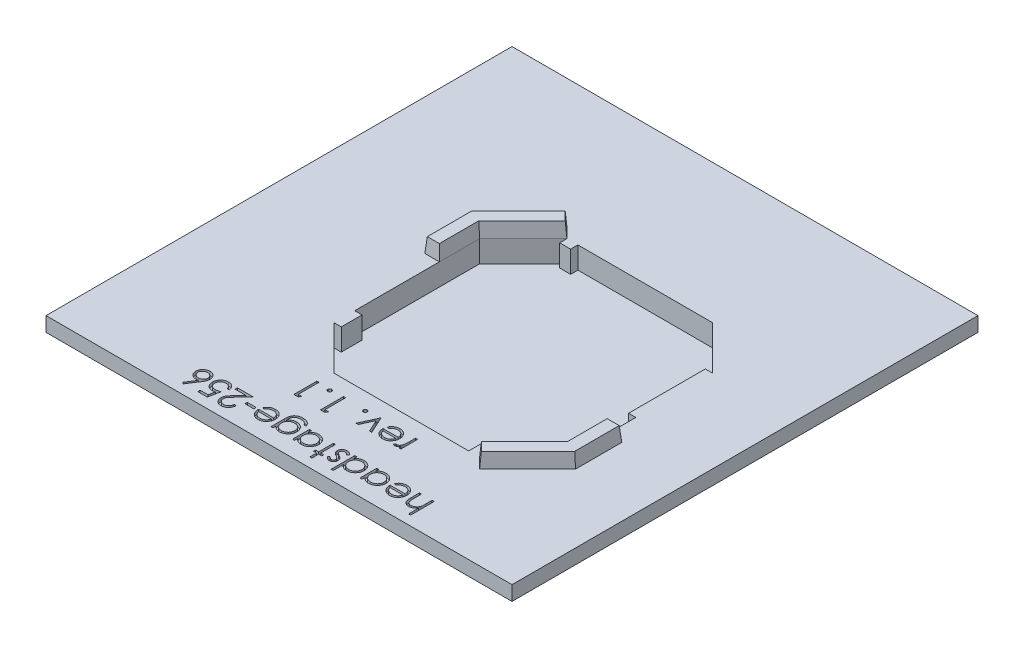
from build123d import *

# Parameters (mm, degrees)
SKETCH1_W           = 64
SKETCH1_H           = 64
BOSS_EXTRUDE1_DEPTH = 4
SKETCH2_W           = 64
SKETCH2_H           = 64
SKETCH2_W_2         = 60
SKETCH2_H_2         = 60
CUT_EXTRUDE1_DEPTH  = 2
CUT_EXTRUDE2_DEPTH  = 3
SKETCH4_W           = 1.5
SKETCH4_H           = 1.5
SKETCH4_W_2         = 1
SKETCH4_H_2         = 10.542710393
SKETCH4_H_3         = 2.856007281
SKETCH4_H_4         = 1
BOSS_EXTRUDE2_DEPTH = 3
BOSS_EXTRUDE3_DEPTH = 2
BOSS_EXTRUDE3_TAPER = 5
CIRPATTERN1_COUNT   = 2
SKETCH6_W           = 1.221153846
SKETCH6_H           = 0.325641025
CUT_EXTRUDE3_DEPTH  = 0.5


with BuildPart() as part:
    # Sketch1 → Boss-Extrude1 (new body)
    with BuildSketch(Plane(origin=(0, 0, 0), x_dir=(1, 0, 0), z_dir=(0, 1, 0))):
        Rectangle(SKETCH1_W, SKETCH1_H)
    extrude(amount=BOSS_EXTRUDE1_DEPTH)

    # Sketch2 → Cut-Extrude1 (cut)
    with BuildSketch(Plane.XZ):
        Rectangle(SKETCH2_W, SKETCH2_H)
        Rectangle(SKETCH2_W_2, SKETCH2_H_2, mode=Mode.SUBTRACT)
    extrude(amount=-CUT_EXTRUDE1_DEPTH, mode=Mode.SUBTRACT)

    # Sketch3 → Cut-Extrude2 (cut)
    with BuildSketch(Plane(origin=(0, 4, 0), x_dir=(1, 0, 0), z_dir=(0, 1, 0))):
        Polygon((20.62, -13.07), (14.62, -19.07), (-5.38, -19.07), (-11.38, -13.07), (-11.38, 6.93), (-5.38, 12.93), (14.62, 12.93), (20.62, 6.93), align=None)
    extrude(amount=-CUT_EXTRUDE2_DEPTH, mode=Mode.SUBTRACT)

    # Sketch4 → Boss-Extrude2 (add)
    with BuildSketch(Plane(origin=(0, 4, 0), x_dir=(1, 0, 0), z_dir=(0, 1, 0))):
        with Locations((13.87, -18.32)):
            Rectangle(SKETCH4_W, SKETCH4_H)
        with Locations((20.12, 1.658644804)):
            Rectangle(SKETCH4_W_2, SKETCH4_H_2)
        with Locations((-10.88, -11.64199636)):
            Rectangle(SKETCH4_W_2, SKETCH4_H_3)
        with Locations((-4.63, 12.43)):
            Rectangle(SKETCH4_W, SKETCH4_H_4)
    extrude(amount=-BOSS_EXTRUDE2_DEPTH)

    # Sketch5 → Boss-Extrude3 (add)
    with BuildSketch(Plane(origin=(0, 4, 0), x_dir=(1, 0, 0), z_dir=(0, 1, 0))):
        Polygon((20.62, -7.542286653), (20.62, -13.07), (14.62, -19.07), (16.034213562, -20.484213562), (22.62, -13.898427125), (22.62, -7.542286653), align=None)
    boss_extrude3 = extrude(amount=BOSS_EXTRUDE3_DEPTH, taper=BOSS_EXTRUDE3_TAPER)

    # CirPattern1: Boss-Extrude3 ×2 about axis
    cirpattern1_axis = Axis((4.62, 0, 3.07), (0, 1, 0))
    for i in range(1, CIRPATTERN1_COUNT):
        add(boss_extrude3.rotate(cirpattern1_axis, i * 360 / CIRPATTERN1_COUNT))

    # Sketch6 → Cut-Extrude3 (cut)
    # profile 1 of 20: a face of its own
    with BuildSketch(Plane(origin=(0, 4, 0), x_dir=(1, 0, 0), z_dir=(0, 1, 0))):
        with BuildLine():
            Line((16.766788287, -30.696783435), (16.481852389, -30.696783435))
            Line((16.481852389, -30.696783435), (16.481852389, -29.32234934))
            add(Edge.make_bspline(
                [(16.481852389, -29.32234934), (16.451217278, -29.360526793), (16.391663794, -29.434742303), (16.29210861, -29.532622215), (16.18837138, -29.615992623), (16.079571753, -29.684072555), (15.966172132, -29.736886045), (15.847893863, -29.773834666), (15.725038492, -29.796875005), (15.641349573, -29.799795056), (15.599059921, -29.801270614)],
                knots=[0, 0, 0, 0, 1.12556596, 2.18805719, 3.205172764, 4.182516927, 5.13416184, 6.075333115, 7.027428072, 8, 8, 8, 8], degree=3))
            add(Edge.make_bspline(
                [(15.599059921, -29.801270614), (15.556103785, -29.799776904), (15.47198612, -29.796851887), (15.349951997, -29.771078781), (15.235178262, -29.730292395), (15.129198064, -29.67297014), (15.033647876, -29.601797307), (14.950773541, -29.518323834), (14.881251153, -29.423649143), (14.834735525, -29.335401279), (14.804249095, -29.256923404), (14.784977828, -29.189574378), (14.768629649, -29.114535589), (14.754388418, -29.031835599), (14.74489625, -28.941080506), (14.737272122, -28.84267881), (14.731850607, -28.736636439), (14.731640511, -28.663230211), (14.731531877, -28.62527402)],
                knots=[0, 0, 0, 0, 1.235689485, 2.419754739, 3.574485241, 4.732583367, 5.875375667, 6.993392835, 8.106934443, 9.24564317, 9.854426656, 10.528623913, 11.260290605, 12.06517837, 12.94359002, 13.886555271, 14.907200199, 16, 16, 16, 16], degree=3))
            Line((14.731531877, -28.62527402), (14.731531877, -27.440373178))
            Line((14.731531877, -27.440373178), (15.016467774, -27.440373178))
            Line((15.016467774, -27.440373178), (15.016467774, -28.531779428))
            add(Edge.make_bspline(
                [(15.016467774, -28.531779428), (15.016639716, -28.563368605), (15.016968612, -28.623793323), (15.018069174, -28.710303481), (15.020470098, -28.788557938), (15.024493312, -28.85871914), (15.028541607, -28.920692003), (15.034281033, -28.974577753), (15.040908881, -29.020038348), (15.046868088, -29.047401949), (15.049540691, -29.05967406)],
                knots=[0, 0, 0, 0, 1.430934443, 2.737134061, 3.918973087, 4.976914145, 5.92044225, 6.731742364, 7.431207999, 8, 8, 8, 8], degree=3))
            add(Edge.make_bspline(
                [(15.049540691, -29.05967406), (15.059856, -29.095708861), (15.07963473, -29.164802537), (15.126525126, -29.258488975), (15.183728065, -29.339090945), (15.254630494, -29.404319106), (15.33687701, -29.455714898), (15.431248433, -29.490730878), (15.536538869, -29.513060951), (15.610596712, -29.515210953), (15.649305314, -29.516334717)],
                knots=[0, 0, 0, 0, 1.090171874, 2.090312098, 3.036871164, 3.954896932, 4.878889889, 5.844924892, 6.87358393, 8, 8, 8, 8], degree=3))
            add(Edge.make_bspline(
                [(15.649305314, -29.516334717), (15.672228832, -29.515909288), (15.717593881, -29.515067374), (15.784827599, -29.506400741), (15.850249971, -29.492712963), (15.913685408, -29.472494897), (15.975263307, -29.44791355), (16.035233977, -29.41774732), (16.092776683, -29.381273102), (16.148634134, -29.340221731), (16.200631928, -29.294808064), (16.249006566, -29.246866577), (16.292130808, -29.195817603), (16.331200126, -29.142477377), (16.364926155, -29.086114996), (16.394365733, -29.027273785), (16.419344544, -28.965876412), (16.431756701, -28.92326332), (16.437967173, -28.901941688)],
                knots=[0, 0, 0, 0, 1.024369801, 2.02720137, 3.025498567, 4.008789058, 4.999724648, 5.987391013, 7.005161842, 8.042127274, 9.083588116, 10.088924978, 11.084112559, 12.068088063, 13.041783903, 14.016724555, 15.007660144, 16, 16, 16, 16], degree=3))
            add(Edge.make_bspline(
                [(16.437967173, -28.901941688), (16.441540796, -28.886501254), (16.449328161, -28.852854648), (16.457778046, -28.797360797), (16.465341618, -28.732875302), (16.47173566, -28.659495972), (16.475657317, -28.576953916), (16.479883007, -28.485812403), (16.481456005, -28.385500527), (16.481716312, -28.315745317), (16.481852389, -28.27928043)],
                knots=[0, 0, 0, 0, 0.607992626, 1.324890765, 2.152360218, 3.099583803, 4.150613268, 5.323148443, 6.60066238, 8, 8, 8, 8], degree=3))
            Line((16.481852389, -28.27928043), (16.481852389, -27.440373178))
            Line((16.481852389, -27.440373178), (16.766788287, -27.440373178))
            Line((16.766788287, -27.440373178), (16.766788287, -30.696783435))
        make_face()
    # profile 2 of 20: a face of its own
    with BuildSketch(Plane(origin=(0, 4, 0), x_dir=(1, 0, 0), z_dir=(0, 1, 0))):
        with BuildLine():
            Line((12.176013046, -28.173065486), (11.92287803, -28.040137802))
            add(Edge.make_bspline(
                [(11.92287803, -28.040137802), (11.943063288, -28.004368478), (11.982335806, -27.934775539), (12.04954861, -27.839109703), (12.12073773, -27.753854616), (12.197317898, -27.679410508), (12.278328437, -27.614028565), (12.36497576, -27.558005878), (12.455818109, -27.509365008), (12.552173126, -27.469720045), (12.653948875, -27.438515136), (12.761772356, -27.415480129), (12.876142518, -27.402119628), (12.954463452, -27.400498268), (12.994567734, -27.39966805)],
                knots=[0, 0, 0, 0, 1.120547187, 2.180141081, 3.186367408, 4.148075574, 5.090720713, 6.023293347, 6.960451315, 7.899733127, 8.862572377, 9.862522039, 10.90550313, 12, 12, 12, 12], degree=3))
            add(Edge.make_bspline(
                [(12.994567734, -27.39966805), (13.039146528, -27.400708702), (13.126106839, -27.402738713), (13.252689328, -27.420239733), (13.371869215, -27.448789663), (13.483639881, -27.488672671), (13.58772732, -27.540767529), (13.684339462, -27.604230509), (13.773980418, -27.678737197), (13.853840332, -27.764926888), (13.925691049, -27.857181037), (13.989249559, -27.953247242), (14.041771042, -28.053084997), (14.086600205, -28.155178502), (14.119769807, -28.260886525), (14.144533994, -28.369277725), (14.158409494, -28.48074903), (14.160570876, -28.556124499), (14.161660082, -28.594109156)],
                knots=[0, 0, 0, 0, 1.145213001, 2.233978795, 3.276616913, 4.289988888, 5.2768102, 6.260573508, 7.254647871, 8.264498533, 9.273731702, 10.25749501, 11.220258744, 12.169609138, 13.119022067, 14.062790212, 15.023763961, 16, 16, 16, 16], degree=3))
            add(Edge.make_bspline(
                [(14.161660082, -28.594109156), (14.160699289, -28.629755181), (14.158795125, -28.700400894), (14.146792911, -28.80496321), (14.125521959, -28.90658902), (14.096333437, -29.005362769), (14.058640521, -29.101119077), (14.012528436, -29.19391622), (13.957925351, -29.283655454), (13.915767997, -29.340264011), (13.894532678, -29.368778627)],
                knots=[0, 0, 0, 0, 1.024358464, 2.0301432, 3.019427413, 4.004406732, 4.986367066, 5.972626655, 6.978780325, 8, 8, 8, 8], degree=3))
            add(Edge.make_bspline(
                [(13.894532678, -29.368778627), (13.865818867, -29.403188061), (13.809393061, -29.470806396), (13.712966714, -29.55884445), (13.609960842, -29.634153479), (13.49933933, -29.695590735), (13.381288513, -29.742845697), (13.256417288, -29.776457528), (13.124380515, -29.797372344), (13.033867863, -29.799951435), (12.98757154, -29.801270614)],
                knots=[0, 0, 0, 0, 1.030811313, 2.025658015, 2.997072178, 3.962767568, 4.930766827, 5.917075773, 6.934604948, 8, 8, 8, 8], degree=3))
            add(Edge.make_bspline(
                [(12.98757154, -29.801270614), (12.939991334, -29.80004845), (12.846649815, -29.797650843), (12.710587902, -29.77522432), (12.581590458, -29.740091824), (12.460722035, -29.688905445), (12.346120227, -29.625456432), (12.240422583, -29.545259851), (12.140727633, -29.452434692), (12.082759495, -29.380973782), (12.053261644, -29.344609957)],
                knots=[0, 0, 0, 0, 1.056389096, 2.072394598, 3.055233004, 4.020130009, 4.981825462, 5.957811105, 6.960805292, 8, 8, 8, 8], degree=3))
            add(Edge.make_bspline(
                [(12.053261644, -29.344609957), (12.03318935, -29.317210994), (11.993178369, -29.262595444), (11.943061357, -29.17354018), (11.899557149, -29.080366998), (11.864783677, -28.9815698), (11.836626415, -28.87831918), (11.816254872, -28.769877015), (11.804308147, -28.656275595), (11.801959829, -28.57887222), (11.800762646, -28.53941164)],
                knots=[0, 0, 0, 0, 0.94817472, 1.890038105, 2.849395472, 3.817997239, 4.812318967, 5.836947057, 6.897266129, 8, 8, 8, 8], degree=3))
            Line((11.800762646, -28.53941164), (13.876724184, -28.53941164))
            add(Edge.make_bspline(
                [(13.876724184, -28.53941164), (13.875326215, -28.508841123), (13.872577165, -28.448725434), (13.859791565, -28.360750292), (13.839540437, -28.276986322), (13.811390781, -28.197790421), (13.776094018, -28.122902563), (13.734215411, -28.051806629), (13.683947804, -27.985582346), (13.627972922, -27.923371531), (13.565637238, -27.867990965), (13.500081102, -27.818384364), (13.430444077, -27.777037121), (13.357428164, -27.742970174), (13.2806547, -27.716749968), (13.200231645, -27.698693844), (13.116409183, -27.686631444), (13.0592727, -27.685287927), (13.030184721, -27.684603948)],
                knots=[0, 0, 0, 0, 1.094405546, 2.152104367, 3.174987145, 4.173015398, 5.153654967, 6.133208507, 7.119289451, 8.123438607, 9.122504012, 10.097966803, 11.060604936, 12.014205423, 12.976096155, 13.956823727, 14.959826266, 16, 16, 16, 16], degree=3))
            add(Edge.make_bspline(
                [(13.030184721, -27.684603948), (13.001742785, -27.68514726), (12.945308528, -27.686225297), (12.861092736, -27.697016237), (12.778047374, -27.713835001), (12.697249287, -27.738238927), (12.619992428, -27.767100165), (12.547845341, -27.800845731), (12.4814855, -27.838881184), (12.419581733, -27.882777794), (12.359864284, -27.936091966), (12.300434993, -28.002748444), (12.23728268, -28.082052717), (12.197204802, -28.141586264), (12.176013046, -28.173065486)],
                knots=[0, 0, 0, 0, 0.991026944, 1.966387566, 2.954903586, 3.941705208, 4.905318989, 5.827751054, 6.715113263, 7.568237245, 8.468614997, 9.499196909, 10.677664282, 12, 12, 12, 12], degree=3))
        make_face()
        with BuildLine():
            add(Edge.make_bspline(
                [(12.085698543, -28.824347537), (12.096067668, -28.862169628), (12.11597302, -28.934775755), (12.158632726, -29.035047377), (12.204448513, -29.125188167), (12.260711564, -29.202918758), (12.324384139, -29.271585987), (12.398157746, -29.331231988), (12.479595133, -29.385942787), (12.570176828, -29.431551071), (12.666401897, -29.469016923), (12.766272513, -29.49656923), (12.868957639, -29.512764545), (12.938118366, -29.515139065), (12.972943135, -29.516334717)],
                knots=[0, 0, 0, 0, 1.154958961, 2.217145986, 3.207012531, 4.129872728, 5.036522214, 5.960144231, 6.920619777, 7.92424629, 8.943461387, 9.961007416, 10.973298156, 12, 12, 12, 12], degree=3))
            add(Edge.make_bspline(
                [(12.972943135, -29.516334717), (13.001382922, -29.515783941), (13.057602402, -29.514695173), (13.140405747, -29.504230924), (13.220276415, -29.487193036), (13.296831508, -29.462815571), (13.37024395, -29.432162385), (13.440850566, -29.395271509), (13.507801501, -29.350384896), (13.549655311, -29.316124777), (13.570799705, -29.298816688)],
                knots=[0, 0, 0, 0, 1.04879286, 2.073242986, 3.073461291, 4.057960153, 5.032623303, 6.005244481, 6.992256684, 8, 8, 8, 8], degree=3))
            add(Edge.make_bspline(
                [(13.570799705, -29.298816688), (13.58594527, -29.285125427), (13.616596202, -29.25741765), (13.657508061, -29.209652979), (13.696971851, -29.158117695), (13.732041178, -29.100562236), (13.765369367, -29.038655648), (13.795739989, -28.971946213), (13.823354365, -28.900152351), (13.838855987, -28.85009919), (13.846831356, -28.824347537)],
                knots=[0, 0, 0, 0, 0.879905587, 1.780714457, 2.708106151, 3.677566983, 4.684151534, 5.740052498, 6.837288539, 8, 8, 8, 8], degree=3))
            Line((13.846831356, -28.824347537), (12.085698543, -28.824347537))
        make_face(mode=Mode.SUBTRACT)
    # profile 3 of 20: a face of its own
    with BuildSketch(Plane(origin=(0, 4, 0), x_dir=(1, 0, 0), z_dir=(0, 1, 0))):
        with BuildLine():
            Line((8.869993415, -29.760565486), (8.869993415, -27.440373178))
            Line((8.869993415, -27.440373178), (9.154929312, -27.440373178))
            Line((9.154929312, -27.440373178), (9.154929312, -27.841700302))
            add(Edge.make_bspline(
                [(9.154929312, -27.841700302), (9.187102744, -27.80542875), (9.249982972, -27.734539098), (9.353998779, -27.641356338), (9.465166361, -27.565277201), (9.581591768, -27.503523617), (9.704176173, -27.456972597), (9.832199644, -27.42417798), (9.965562012, -27.402844616), (10.05650792, -27.400736405), (10.102595578, -27.39966805)],
                knots=[0, 0, 0, 0, 1.074235403, 2.099501444, 3.086304576, 4.053325556, 5.01427503, 5.985443889, 6.979105517, 8, 8, 8, 8], degree=3))
            add(Edge.make_bspline(
                [(10.102595578, -27.39966805), (10.143569476, -27.40078036), (10.224371818, -27.402973885), (10.343232308, -27.41999663), (10.457621903, -27.447319606), (10.567613506, -27.485365776), (10.672461834, -27.535572305), (10.772757679, -27.596329141), (10.868735113, -27.667972183), (10.958568847, -27.750194374), (11.041397776, -27.839404912), (11.113864722, -27.93483311), (11.175282819, -28.035168266), (11.225757495, -28.140382178), (11.264817446, -28.250397935), (11.291992603, -28.365140065), (11.308997003, -28.484417643), (11.311189417, -28.565643128), (11.312301107, -28.606829508)],
                knots=[0, 0, 0, 0, 1.034036272, 2.039165313, 3.024406509, 3.999331371, 4.971254918, 5.953351348, 6.95522652, 7.989525907, 9.023492927, 10.024309745, 11.009187477, 11.988246066, 12.964946762, 13.950187958, 14.960617622, 16, 16, 16, 16], degree=3))
            add(Edge.make_bspline(
                [(11.312301107, -28.606829508), (11.31116476, -28.647164611), (11.308918263, -28.726904934), (11.292174555, -28.844176697), (11.264039768, -28.95714172), (11.22448093, -29.065381539), (11.173979413, -29.169332071), (11.111505064, -29.268180006), (11.03906423, -29.363437438), (10.95535007, -29.452049631), (10.864710045, -29.533604744), (10.768195627, -29.605421892), (10.667010253, -29.666022953), (10.560951032, -29.715285723), (10.450768957, -29.75443292), (10.335627035, -29.781722285), (10.216048884, -29.797764063), (10.134869077, -29.800090533), (10.093691332, -29.801270614)],
                knots=[0, 0, 0, 0, 1.02050356, 2.017480486, 2.990790918, 3.96161403, 4.928589988, 5.909588639, 6.91611943, 7.952353252, 8.989586576, 9.99823133, 10.991940466, 11.968822692, 12.952985106, 13.945868367, 14.958059758, 16, 16, 16, 16], degree=3))
            add(Edge.make_bspline(
                [(10.093691332, -29.801270614), (10.046337657, -29.799971265), (9.953479337, -29.797423303), (9.817465595, -29.776038198), (9.688735792, -29.740244084), (9.566174927, -29.691388805), (9.451505378, -29.625598131), (9.343624779, -29.544192979), (9.243813173, -29.445199821), (9.18506979, -29.369892704), (9.154929312, -29.331253587)],
                knots=[0, 0, 0, 0, 1.038908319, 2.037250181, 3.012632028, 3.966567879, 4.9252131, 5.905168122, 6.925168603, 8, 8, 8, 8], degree=3))
            Line((9.154929312, -29.331253587), (9.154929312, -29.760565486))
            Line((9.154929312, -29.760565486), (8.869993415, -29.760565486))
        make_face()
        with BuildLine():
            add(Edge.make_bspline(
                [(10.089875226, -29.516334717), (10.131525218, -29.514851522), (10.213735678, -29.51192393), (10.334438195, -29.489106085), (10.449882301, -29.45104272), (10.559880263, -29.399286653), (10.661395236, -29.332988729), (10.75362631, -29.254818335), (10.834073258, -29.163817735), (10.902093416, -29.062077682), (10.958562754, -28.953661296), (10.997530982, -28.839502127), (11.023413856, -28.722685665), (11.026044663, -28.643431483), (11.02736521, -28.60364942)],
                knots=[0, 0, 0, 0, 1.031179624, 2.035384561, 3.030098214, 4.035455833, 5.037557836, 6.024646278, 7.02156144, 8.035264006, 9.049836703, 10.039645228, 11.015989397, 12, 12, 12, 12], degree=3))
            add(Edge.make_bspline(
                [(11.02736521, -28.60364942), (11.025650977, -28.564114823), (11.022229229, -28.48520059), (10.998326142, -28.368205111), (10.956369296, -28.254790741), (10.901135202, -28.144976816), (10.832044319, -28.042477893), (10.75175615, -27.949797015), (10.659057077, -27.870421628), (10.556648202, -27.803936316), (10.447386114, -27.750454225), (10.332443217, -27.712733136), (10.213822931, -27.688916372), (10.133023298, -27.686046258), (10.092419296, -27.684603948)],
                knots=[0, 0, 0, 0, 0.979235476, 1.954632679, 2.943119654, 3.967171814, 4.992637064, 5.997548408, 6.995574264, 8.005058949, 9.015076297, 9.999929117, 10.994910263, 12, 12, 12, 12], degree=3))
            add(Edge.make_bspline(
                [(10.092419296, -27.684603948), (10.051193482, -27.68610452), (9.969407962, -27.68908142), (9.84828809, -27.712056629), (9.730965142, -27.750592622), (9.61839458, -27.803067263), (9.513703728, -27.868123053), (9.420179343, -27.944622844), (9.339383268, -28.032229403), (9.272861017, -28.130419258), (9.219710637, -28.236877368), (9.182076136, -28.350584966), (9.159218265, -28.470866361), (9.156378731, -28.553302358), (9.154929312, -28.595381191)],
                knots=[0, 0, 0, 0, 1.017730373, 2.019016736, 3.032373701, 4.060729657, 5.079187105, 6.068726676, 7.03591854, 8.011858086, 8.988317194, 9.965225429, 10.961364673, 12, 12, 12, 12], degree=3))
            add(Edge.make_bspline(
                [(9.154929312, -28.595381191), (9.155799872, -28.627437639), (9.157513408, -28.690534874), (9.170603799, -28.783179299), (9.191427916, -28.871837103), (9.220767894, -28.956605326), (9.259323298, -29.037001191), (9.305775639, -29.113654889), (9.361077724, -29.185852401), (9.423546569, -29.253502297), (9.492695375, -29.31489713), (9.566226168, -29.369010021), (9.643953946, -29.414804417), (9.725824148, -29.451451912), (9.811206204, -29.481307707), (9.900918485, -29.501026944), (9.994056855, -29.514610454), (10.05759948, -29.515753911), (10.089875226, -29.516334717)],
                knots=[0, 0, 0, 0, 1.050062701, 2.066855696, 3.059271411, 4.030305351, 4.999747758, 5.975466543, 6.961907836, 7.974539719, 8.98812422, 9.98710676, 10.961662635, 11.93785114, 12.922015094, 13.919620009, 14.94329489, 16, 16, 16, 16], degree=3))
        make_face(mode=Mode.SUBTRACT)
    # profile 4 of 20: a face of its own
    with BuildSketch(Plane(origin=(0, 4, 0), x_dir=(1, 0, 0), z_dir=(0, 1, 0))):
        with BuildLine():
            Line((5.857813928, -30.696783435), (5.857813928, -27.440373178))
            Line((5.857813928, -27.440373178), (6.142749825, -27.440373178))
            Line((6.142749825, -27.440373178), (6.142749825, -27.841700302))
            add(Edge.make_bspline(
                [(6.142749825, -27.841700302), (6.174923257, -27.80542875), (6.237803484, -27.734539098), (6.341819292, -27.641356338), (6.452986873, -27.565277201), (6.569412281, -27.503523617), (6.691996686, -27.456972597), (6.820020157, -27.42417798), (6.953382525, -27.402844616), (7.044328432, -27.400736405), (7.090416091, -27.39966805)],
                knots=[0, 0, 0, 0, 1.074235403, 2.099501444, 3.086304576, 4.053325556, 5.01427503, 5.985443889, 6.979105517, 8, 8, 8, 8], degree=3))
            add(Edge.make_bspline(
                [(7.090416091, -27.39966805), (7.131389989, -27.40078036), (7.21219233, -27.402973885), (7.331052821, -27.41999663), (7.445442416, -27.447319606), (7.555434019, -27.485365776), (7.660282347, -27.535572305), (7.760578191, -27.596329141), (7.856555626, -27.667972183), (7.94638936, -27.750194374), (8.029218288, -27.839404912), (8.101685235, -27.93483311), (8.163103332, -28.035168266), (8.213578008, -28.140382178), (8.252637959, -28.250397935), (8.279813116, -28.365140065), (8.296817516, -28.484417643), (8.29900993, -28.565643128), (8.30012162, -28.606829508)],
                knots=[0, 0, 0, 0, 1.034036272, 2.039165313, 3.024406509, 3.999331371, 4.971254918, 5.953351348, 6.95522652, 7.989525907, 9.023492927, 10.024309745, 11.009187477, 11.988246066, 12.964946762, 13.950187958, 14.960617622, 16, 16, 16, 16], degree=3))
            add(Edge.make_bspline(
                [(8.30012162, -28.606829508), (8.298985273, -28.647164611), (8.296738776, -28.726904934), (8.279995068, -28.844176697), (8.251860281, -28.95714172), (8.212301442, -29.065381539), (8.161799926, -29.169332071), (8.099325576, -29.268180006), (8.026884743, -29.363437438), (7.943170583, -29.452049631), (7.852530558, -29.533604744), (7.756016139, -29.605421892), (7.654830765, -29.666022953), (7.548771545, -29.715285723), (7.43858947, -29.75443292), (7.323447548, -29.781722285), (7.203869397, -29.797764063), (7.122689589, -29.800090533), (7.081511844, -29.801270614)],
                knots=[0, 0, 0, 0, 1.02050356, 2.017480486, 2.990790918, 3.96161403, 4.928589988, 5.909588639, 6.91611943, 7.952353252, 8.989586576, 9.99823133, 10.991940466, 11.968822692, 12.952985106, 13.945868367, 14.958059758, 16, 16, 16, 16], degree=3))
            add(Edge.make_bspline(
                [(7.081511844, -29.801270614), (7.034136558, -29.799873791), (6.941144135, -29.797131984), (6.805126269, -29.773436764), (6.675999392, -29.735508825), (6.553768464, -29.681634105), (6.43950638, -29.611422493), (6.331685697, -29.526985551), (6.231958465, -29.426200513), (6.172939406, -29.350340929), (6.142749825, -29.311537041)],
                knots=[0, 0, 0, 0, 1.03083325, 2.023411113, 2.996083796, 3.9549903, 4.922369457, 5.908572979, 6.930187902, 8, 8, 8, 8], degree=3))
            Line((6.142749825, -29.311537041), (6.142749825, -30.696783435))
            Line((6.142749825, -30.696783435), (5.857813928, -30.696783435))
        make_face()
        with BuildLine():
            add(Edge.make_bspline(
                [(7.077695739, -29.516334717), (7.119345731, -29.514851522), (7.201556191, -29.51192393), (7.322258708, -29.489106085), (7.437702814, -29.45104272), (7.547700775, -29.399286653), (7.649215749, -29.332988729), (7.741446823, -29.254818335), (7.821893771, -29.163817735), (7.889913929, -29.062077682), (7.946383266, -28.953661296), (7.985351495, -28.839502127), (8.011234369, -28.722685665), (8.013865175, -28.643431483), (8.015185723, -28.60364942)],
                knots=[0, 0, 0, 0, 1.031179624, 2.035384561, 3.030098214, 4.035455833, 5.037557836, 6.024646278, 7.02156144, 8.035264006, 9.049836703, 10.039645228, 11.015989397, 12, 12, 12, 12], degree=3))
            add(Edge.make_bspline(
                [(8.015185723, -28.60364942), (8.013471489, -28.564114823), (8.010049742, -28.48520059), (7.986146655, -28.368205111), (7.944189809, -28.254790741), (7.888955714, -28.144976816), (7.819864831, -28.042477893), (7.739576662, -27.949797015), (7.64687759, -27.870421628), (7.544468715, -27.803936316), (7.435206626, -27.750454225), (7.32026373, -27.712733136), (7.201643444, -27.688916372), (7.120843811, -27.686046258), (7.080239809, -27.684603948)],
                knots=[0, 0, 0, 0, 0.979235476, 1.954632679, 2.943119654, 3.967171814, 4.992637064, 5.997548408, 6.995574264, 8.005058949, 9.015076297, 9.999929117, 10.994910263, 12, 12, 12, 12], degree=3))
            add(Edge.make_bspline(
                [(7.080239809, -27.684603948), (7.039013995, -27.68610452), (6.957228474, -27.68908142), (6.836108603, -27.712056629), (6.718785655, -27.750592622), (6.606215093, -27.803067263), (6.501524241, -27.868123053), (6.407999855, -27.944622844), (6.327203781, -28.032229403), (6.26068153, -28.130419258), (6.207531149, -28.236877368), (6.169896648, -28.350584966), (6.147038778, -28.470866361), (6.144199244, -28.553302358), (6.142749825, -28.595381191)],
                knots=[0, 0, 0, 0, 1.017730373, 2.019016736, 3.032373701, 4.060729657, 5.079187105, 6.068726676, 7.03591854, 8.011858086, 8.988317194, 9.965225429, 10.961364673, 12, 12, 12, 12], degree=3))
            add(Edge.make_bspline(
                [(6.142749825, -28.595381191), (6.143620384, -28.627437639), (6.14533392, -28.690534874), (6.158424312, -28.783179299), (6.179248429, -28.871837103), (6.208588407, -28.956605326), (6.247143811, -29.037001191), (6.293596152, -29.113654889), (6.348898237, -29.185852401), (6.411367082, -29.253502297), (6.480515888, -29.31489713), (6.554046681, -29.369010021), (6.631774459, -29.414804417), (6.713644661, -29.451451912), (6.799026717, -29.481307707), (6.888738998, -29.501026944), (6.981877368, -29.514610454), (7.045419993, -29.515753911), (7.077695739, -29.516334717)],
                knots=[0, 0, 0, 0, 1.050062701, 2.066855696, 3.059271411, 4.030305351, 4.999747758, 5.975466543, 6.961907836, 7.974539719, 8.98812422, 9.98710676, 10.961662635, 11.93785114, 12.922015094, 13.919620009, 14.94329489, 16, 16, 16, 16], degree=3))
        make_face(mode=Mode.SUBTRACT)
    # profile 5 of 20: a face of its own
    with BuildSketch(Plane(origin=(0, 4, 0), x_dir=(1, 0, 0), z_dir=(0, 1, 0))):
        with BuildLine():
            Line((4.107493415, -29.471177465), (4.300842774, -29.272103948))
            add(Edge.make_bspline(
                [(4.300842774, -29.272103948), (4.317522851, -29.291442196), (4.349680076, -29.328724062), (4.40072658, -29.378504059), (4.45155902, -29.420657203), (4.50190929, -29.455342027), (4.551871354, -29.482639303), (4.601871791, -29.501919083), (4.651773393, -29.514022858), (4.685146261, -29.515573352), (4.70153388, -29.516334717)],
                knots=[0, 0, 0, 0, 1.265880991, 2.440469525, 3.530740057, 4.536711111, 5.468008477, 6.34654737, 7.188078389, 8, 8, 8, 8], degree=3))
            add(Edge.make_bspline(
                [(4.70153388, -29.516334717), (4.721609675, -29.515347605), (4.761116, -29.513405109), (4.817681445, -29.494485817), (4.869551864, -29.464618359), (4.91545599, -29.423894898), (4.953782189, -29.37563599), (4.982508503, -29.322130599), (4.999698406, -29.26423696), (5.001893107, -29.224303762), (5.003006235, -29.204050061)],
                knots=[0, 0, 0, 0, 0.999905305, 1.967672129, 2.944835807, 3.972828834, 5.013019963, 6.007753697, 6.989553527, 8, 8, 8, 8], degree=3))
            add(Edge.make_bspline(
                [(5.003006235, -29.204050061), (5.00199857, -29.18571485), (4.99998608, -29.149096114), (4.984340878, -29.09507754), (4.959425227, -29.042411513), (4.936138693, -29.010150876), (4.92414005, -28.993528226)],
                knots=[0, 0, 0, 0, 0.960159726, 1.917612774, 2.927026955, 4, 4, 4, 4], degree=3))
            add(Edge.make_bspline(
                [(4.92414005, -28.993528226), (4.916878863, -28.984691526), (4.901330764, -28.965769839), (4.873129314, -28.938841703), (4.839721831, -28.910684642), (4.800791143, -28.881489682), (4.756258998, -28.85122624), (4.706778013, -28.819380231), (4.651736639, -28.786883866), (4.612973387, -28.765518523), (4.592774865, -28.754385598)],
                knots=[0, 0, 0, 0, 0.667332049, 1.428932371, 2.272176193, 3.217953793, 4.268659351, 5.415594948, 6.6533338, 8, 8, 8, 8], degree=3))
            add(Edge.make_bspline(
                [(4.592774865, -28.754385598), (4.568083845, -28.740562109), (4.520388924, -28.71385968), (4.452691374, -28.672316187), (4.390889269, -28.631302481), (4.335835934, -28.589880832), (4.286240477, -28.549755098), (4.242899847, -28.509816027), (4.205679809, -28.469958056), (4.18486188, -28.442073086), (4.174911284, -28.428744573)],
                knots=[0, 0, 0, 0, 1.271974443, 2.457035787, 3.569878245, 4.604907449, 5.553098313, 6.436573686, 7.252710343, 8, 8, 8, 8], degree=3))
            add(Edge.make_bspline(
                [(4.174911284, -28.428744573), (4.1582845, -28.401871065), (4.125130464, -28.348284918), (4.092245012, -28.259554194), (4.070629031, -28.166472072), (4.068085111, -28.102594011), (4.066788287, -28.07003063)],
                knots=[0, 0, 0, 0, 0.995678878, 1.985397446, 2.973007791, 4, 4, 4, 4], degree=3))
            add(Edge.make_bspline(
                [(4.066788287, -28.07003063), (4.067439562, -28.047107202), (4.06872297, -28.001934084), (4.077686385, -27.935418996), (4.092990725, -27.871759878), (4.114189359, -27.810571948), (4.141424458, -27.752020058), (4.175374404, -27.696518835), (4.215432147, -27.644079305), (4.26003747, -27.594013809), (4.3098525, -27.548524096), (4.363630821, -27.509133064), (4.419750087, -27.474863861), (4.479443871, -27.447612427), (4.541962184, -27.425711316), (4.607660994, -27.410614644), (4.676263968, -27.401562855), (4.722918581, -27.400307638), (4.746691131, -27.39966805)],
                knots=[0, 0, 0, 0, 1.032810722, 2.035266353, 3.017676364, 3.978389067, 4.948507077, 5.921677479, 6.903715858, 7.918386526, 8.939467451, 9.936812204, 10.918153393, 11.89693397, 12.887853058, 13.89815236, 14.929017384, 16, 16, 16, 16], degree=3))
            add(Edge.make_bspline(
                [(4.746691131, -27.39966805), (4.778775804, -27.400564492), (4.842499336, -27.402344921), (4.936718656, -27.419192753), (5.028979533, -27.445105801), (5.117956336, -27.482050688), (5.202289801, -27.527471039), (5.279906634, -27.581210691), (5.349999282, -27.642985575), (5.390038106, -27.690235697), (5.410057518, -27.713860758)],
                knots=[0, 0, 0, 0, 1.014105853, 2.01412079, 3.018242674, 4.040740662, 5.055023907, 6.042888753, 7.021444376, 8, 8, 8, 8], degree=3))
            Line((5.410057518, -27.713860758), (5.221160282, -27.928834717))
            add(Edge.make_bspline(
                [(5.221160282, -27.928834717), (5.203223879, -27.909462895), (5.168451449, -27.871907688), (5.112842488, -27.821902037), (5.05625546, -27.779990883), (4.999255423, -27.744935786), (4.940998623, -27.717925241), (4.88181153, -27.698949088), (4.821814531, -27.686753285), (4.781517308, -27.685321558), (4.761319537, -27.684603948)],
                knots=[0, 0, 0, 0, 1.179806542, 2.287233372, 3.337373186, 4.324005949, 5.273901747, 6.200048787, 7.097828587, 8, 8, 8, 8], degree=3))
            add(Edge.make_bspline(
                [(4.761319537, -27.684603948), (4.73381705, -27.685847592), (4.680081805, -27.688277466), (4.603113535, -27.710334984), (4.532059924, -27.744930134), (4.470312222, -27.793970451), (4.418057737, -27.851025243), (4.379457543, -27.915059062), (4.356068604, -27.984927246), (4.353185152, -28.033391018), (4.351724184, -28.057946295)],
                knots=[0, 0, 0, 0, 1.072236613, 2.094970478, 3.102399718, 4.141104368, 5.155589565, 6.110053346, 7.042415349, 8, 8, 8, 8], degree=3))
            add(Edge.make_bspline(
                [(4.351724184, -28.057946295), (4.352679184, -28.078193323), (4.354555002, -28.117962678), (4.37020524, -28.175660691), (4.393876109, -28.230705263), (4.417819008, -28.262941598), (4.429954352, -28.27928043)],
                knots=[0, 0, 0, 0, 1.014054094, 1.991812201, 2.982159616, 4, 4, 4, 4], degree=3))
            add(Edge.make_bspline(
                [(4.429954352, -28.27928043), (4.437230235, -28.287479042), (4.453079736, -28.305338579), (4.482189294, -28.331080125), (4.516766381, -28.359003174), (4.558346762, -28.387418518), (4.604832577, -28.418897112), (4.658706648, -28.450113729), (4.717880921, -28.484159746), (4.759773487, -28.506660946), (4.781672101, -28.518423058)],
                knots=[0, 0, 0, 0, 0.615029206, 1.339755737, 2.178261527, 3.109653826, 4.166232585, 5.329982127, 6.604294388, 8, 8, 8, 8], degree=3))
            add(Edge.make_bspline(
                [(4.781672101, -28.518423058), (4.805300124, -28.531612128), (4.851122402, -28.557189942), (4.916026016, -28.597028101), (4.974579688, -28.6375477), (5.028192352, -28.676475776), (5.075509835, -28.715864775), (5.116345731, -28.755758424), (5.152307791, -28.79454784), (5.172217229, -28.822031816), (5.181727189, -28.835159837)],
                knots=[0, 0, 0, 0, 1.262093308, 2.447601706, 3.550203992, 4.582594899, 5.537233252, 6.418365656, 7.244515135, 8, 8, 8, 8], degree=3))
            add(Edge.make_bspline(
                [(5.181727189, -28.835159837), (5.198150397, -28.861607332), (5.230897782, -28.914342847), (5.263259051, -29.002474041), (5.284889595, -29.095506912), (5.286911632, -29.159823668), (5.287942133, -29.192601744)],
                knots=[0, 0, 0, 0, 0.984940175, 1.963941237, 2.962352981, 4, 4, 4, 4], degree=3))
            add(Edge.make_bspline(
                [(5.287942133, -29.192601744), (5.287458114, -29.214033589), (5.286510821, -29.255978746), (5.27893351, -29.317605668), (5.265181885, -29.376172083), (5.247732468, -29.432671965), (5.223987544, -29.486066615), (5.19520047, -29.536911289), (5.160728771, -29.584382028), (5.121940305, -29.628804266), (5.079794492, -29.669600767), (5.033590109, -29.704498717), (4.985252536, -29.734763431), (4.933724397, -29.759002645), (4.87966385, -29.778266377), (4.822649798, -29.791314617), (4.763076486, -29.800091519), (4.722343516, -29.800871922), (4.70153388, -29.801270614)],
                knots=[0, 0, 0, 0, 1.087410352, 2.12821612, 3.143409386, 4.13688077, 5.124334423, 6.102425883, 7.096654197, 8.095527921, 9.09231389, 10.067027194, 11.028349958, 11.981147348, 12.950860869, 13.934615631, 14.944837612, 16, 16, 16, 16], degree=3))
            add(Edge.make_bspline(
                [(4.70153388, -29.801270614), (4.676865583, -29.800271165), (4.627066238, -29.798253517), (4.55237771, -29.782155345), (4.47788381, -29.755939101), (4.403508188, -29.718880826), (4.328933972, -29.672270156), (4.254495432, -29.614898774), (4.178983172, -29.548386121), (4.131855781, -29.497488725), (4.107493415, -29.471177465)],
                knots=[0, 0, 0, 0, 0.845753203, 1.707371858, 2.609134499, 3.549244224, 4.552329203, 5.621587647, 6.770486714, 8, 8, 8, 8], degree=3))
        make_face()
    # profile 6 of 20: a face of its own
    with BuildSketch(Plane(origin=(0, 4, 0), x_dir=(1, 0, 0), z_dir=(0, 1, 0))):
        Polygon((3.211980594, -30.696783435), (2.927044697, -30.696783435), (2.927044697, -29.760565486), (2.519993415, -29.760565486), (2.519993415, -29.475629589), (2.927044697, -29.475629589), (2.927044697, -27.440373178), (3.211980594, -27.440373178), (3.211980594, -29.475629589), (3.619031877, -29.475629589), (3.619031877, -29.760565486), (3.211980594, -29.760565486), align=None)
    # profile 7 of 20: a face of its own
    with BuildSketch(Plane(origin=(0, 4, 0), x_dir=(1, 0, 0), z_dir=(0, 1, 0))):
        with BuildLine():
            Line((-0.370070688, -29.760565486), (-0.370070688, -27.440373178))
            Line((-0.370070688, -27.440373178), (-0.08513479, -27.440373178))
            Line((-0.08513479, -27.440373178), (-0.08513479, -27.841700302))
            add(Edge.make_bspline(
                [(-0.08513479, -27.841700302), (-0.052961358, -27.80542875), (0.009918869, -27.734539098), (0.113934677, -27.641356338), (0.225102258, -27.565277201), (0.341527665, -27.503523617), (0.46411207, -27.456972597), (0.592135541, -27.42417798), (0.72549791, -27.402844616), (0.816443817, -27.400736405), (0.862531476, -27.39966805)],
                knots=[0, 0, 0, 0, 1.074235403, 2.099501444, 3.086304576, 4.053325556, 5.01427503, 5.985443889, 6.979105517, 8, 8, 8, 8], degree=3))
            add(Edge.make_bspline(
                [(0.862531476, -27.39966805), (0.903505374, -27.40078036), (0.984307715, -27.402973885), (1.103168205, -27.41999663), (1.217557801, -27.447319606), (1.327549404, -27.485365776), (1.432397731, -27.535572305), (1.532693576, -27.596329141), (1.62867101, -27.667972183), (1.718504744, -27.750194374), (1.801333673, -27.839404912), (1.87380062, -27.93483311), (1.935218717, -28.035168266), (1.985693393, -28.140382178), (2.024753343, -28.250397935), (2.0519285, -28.365140065), (2.068932901, -28.484417643), (2.071125314, -28.565643128), (2.072237005, -28.606829508)],
                knots=[0, 0, 0, 0, 1.034036272, 2.039165313, 3.024406509, 3.999331371, 4.971254918, 5.953351348, 6.95522652, 7.989525907, 9.023492927, 10.024309745, 11.009187477, 11.988246066, 12.964946762, 13.950187958, 14.960617622, 16, 16, 16, 16], degree=3))
            add(Edge.make_bspline(
                [(2.072237005, -28.606829508), (2.071100658, -28.647164611), (2.068854161, -28.726904934), (2.052110453, -28.844176697), (2.023975666, -28.95714172), (1.984416827, -29.065381539), (1.93391531, -29.169332071), (1.871440961, -29.268180006), (1.799000128, -29.363437438), (1.715285967, -29.452049631), (1.624645943, -29.533604744), (1.528131524, -29.605421892), (1.42694615, -29.666022953), (1.320886929, -29.715285723), (1.210704855, -29.75443292), (1.095562933, -29.781722285), (0.975984781, -29.797764063), (0.894804974, -29.800090533), (0.853627229, -29.801270614)],
                knots=[0, 0, 0, 0, 1.02050356, 2.017480486, 2.990790918, 3.96161403, 4.928589988, 5.909588639, 6.91611943, 7.952353252, 8.989586576, 9.99823133, 10.991940466, 11.968822692, 12.952985106, 13.945868367, 14.958059758, 16, 16, 16, 16], degree=3))
            add(Edge.make_bspline(
                [(0.853627229, -29.801270614), (0.806273555, -29.799971265), (0.713415235, -29.797423303), (0.577401492, -29.776038198), (0.448671689, -29.740244084), (0.326110825, -29.691388805), (0.211441276, -29.625598131), (0.103560677, -29.544192979), (0.00374907, -29.445199821), (-0.054994313, -29.369892704), (-0.08513479, -29.331253587)],
                knots=[0, 0, 0, 0, 1.038908319, 2.037250181, 3.012632028, 3.966567879, 4.9252131, 5.905168122, 6.925168603, 8, 8, 8, 8], degree=3))
            Line((-0.08513479, -29.331253587), (-0.08513479, -29.760565486))
            Line((-0.08513479, -29.760565486), (-0.370070688, -29.760565486))
        make_face()
        with BuildLine():
            add(Edge.make_bspline(
                [(0.849811123, -29.516334717), (0.891461116, -29.514851522), (0.973671576, -29.51192393), (1.094374092, -29.489106085), (1.209818198, -29.45104272), (1.31981616, -29.399286653), (1.421331134, -29.332988729), (1.513562208, -29.254818335), (1.594009156, -29.163817735), (1.662029314, -29.062077682), (1.718498651, -28.953661296), (1.75746688, -28.839502127), (1.783349754, -28.722685665), (1.78598056, -28.643431483), (1.787301107, -28.60364942)],
                knots=[0, 0, 0, 0, 1.031179624, 2.035384561, 3.030098214, 4.035455833, 5.037557836, 6.024646278, 7.02156144, 8.035264006, 9.049836703, 10.039645228, 11.015989397, 12, 12, 12, 12], degree=3))
            add(Edge.make_bspline(
                [(1.787301107, -28.60364942), (1.785586874, -28.564114823), (1.782165127, -28.48520059), (1.75826204, -28.368205111), (1.716305194, -28.254790741), (1.661071099, -28.144976816), (1.591980216, -28.042477893), (1.511692047, -27.949797015), (1.418992974, -27.870421628), (1.316584099, -27.803936316), (1.207322011, -27.750454225), (1.092379115, -27.712733136), (0.973758829, -27.688916372), (0.892959196, -27.686046258), (0.852355194, -27.684603948)],
                knots=[0, 0, 0, 0, 0.979235476, 1.954632679, 2.943119654, 3.967171814, 4.992637064, 5.997548408, 6.995574264, 8.005058949, 9.015076297, 9.999929117, 10.994910263, 12, 12, 12, 12], degree=3))
            add(Edge.make_bspline(
                [(0.852355194, -27.684603948), (0.81112938, -27.68610452), (0.729343859, -27.68908142), (0.608223988, -27.712056629), (0.49090104, -27.750592622), (0.378330477, -27.803067263), (0.273639626, -27.868123053), (0.18011524, -27.944622844), (0.099319166, -28.032229403), (0.032796914, -28.130419258), (-0.020353466, -28.236877368), (-0.057987967, -28.350584966), (-0.080845837, -28.470866361), (-0.083685371, -28.553302358), (-0.08513479, -28.595381191)],
                knots=[0, 0, 0, 0, 1.017730373, 2.019016736, 3.032373701, 4.060729657, 5.079187105, 6.068726676, 7.03591854, 8.011858086, 8.988317194, 9.965225429, 10.961364673, 12, 12, 12, 12], degree=3))
            add(Edge.make_bspline(
                [(-0.08513479, -28.595381191), (-0.084264231, -28.627437639), (-0.082550695, -28.690534874), (-0.069460304, -28.783179299), (-0.048636186, -28.871837103), (-0.019296208, -28.956605326), (0.019259196, -29.037001191), (0.065711537, -29.113654889), (0.121013621, -29.185852401), (0.183482466, -29.253502297), (0.252631272, -29.31489713), (0.326162066, -29.369010021), (0.403889844, -29.414804417), (0.485760046, -29.451451912), (0.571142102, -29.481307707), (0.660854383, -29.501026944), (0.753992753, -29.514610454), (0.817535377, -29.515753911), (0.849811123, -29.516334717)],
                knots=[0, 0, 0, 0, 1.050062701, 2.066855696, 3.059271411, 4.030305351, 4.999747758, 5.975466543, 6.961907836, 7.974539719, 8.98812422, 9.98710676, 10.961662635, 11.93785114, 12.922015094, 13.919620009, 14.94329489, 16, 16, 16, 16], degree=3))
        make_face(mode=Mode.SUBTRACT)
    # profile 8 of 20: a face of its own
    with BuildSketch(Plane(origin=(0, 4, 0), x_dir=(1, 0, 0), z_dir=(0, 1, 0))):
        with BuildLine():
            Line((-3.056609149, -29.760565486), (-3.341545047, -29.760565486))
            Line((-3.341545047, -29.760565486), (-3.341545047, -27.919294452))
            add(Edge.make_bspline(
                [(-3.341545047, -27.919294452), (-3.341293729, -27.880071777), (-3.340808627, -27.804362566), (-3.337315246, -27.694890127), (-3.329948631, -27.593774464), (-3.321595042, -27.500554415), (-3.309578378, -27.415662072), (-3.294904102, -27.338844122), (-3.278361736, -27.270026848), (-3.26382911, -27.227640742), (-3.256954702, -27.207590726)],
                knots=[0, 0, 0, 0, 1.307562039, 2.523909702, 3.650326591, 4.686913197, 5.643429486, 6.506965704, 7.293745905, 8, 8, 8, 8], degree=3))
            add(Edge.make_bspline(
                [(-3.256954702, -27.207590726), (-3.246805398, -27.181527737), (-3.226810247, -27.130181025), (-3.189344874, -27.057409181), (-3.147453807, -26.98883279), (-3.099451785, -26.925216078), (-3.046495519, -26.865630423), (-2.987926933, -26.81093534), (-2.923888914, -26.761199404), (-2.85495513, -26.715951118), (-2.78161607, -26.675516171), (-2.704273303, -26.640272163), (-2.623120721, -26.611126243), (-2.538517176, -26.587093888), (-2.450425361, -26.567719364), (-2.358563746, -26.554789083), (-2.263239523, -26.546083329), (-2.198429485, -26.545271988), (-2.165548452, -26.544860358)],
                knots=[0, 0, 0, 0, 0.981980677, 1.934600764, 2.870922996, 3.801898166, 4.730277883, 5.66822786, 6.612778219, 7.575390338, 8.562104565, 9.552017954, 10.558022676, 11.588218111, 12.640020657, 13.7238485, 14.84520645, 16, 16, 16, 16], degree=3))
            add(Edge.make_bspline(
                [(-2.165548452, -26.544860358), (-2.117587389, -26.545733042), (-2.023931642, -26.547437172), (-1.887113387, -26.563781814), (-1.757766585, -26.589982125), (-1.636761294, -26.627700485), (-1.525018322, -26.674144539), (-1.42290021, -26.726926603), (-1.332111016, -26.78808796), (-1.25034194, -26.857457778), (-1.176557407, -26.9399824), (-1.107135042, -27.037224781), (-1.040314405, -27.150679014), (-1.001154231, -27.233948015), (-0.980647611, -27.277552666)],
                knots=[0, 0, 0, 0, 1.157891388, 2.261067142, 3.322482332, 4.341146062, 5.316743571, 6.242014582, 7.11254001, 7.955027914, 8.825041224, 9.77858257, 10.836732392, 12, 12, 12, 12], degree=3))
            Line((-0.980647611, -27.277552666), (-1.265583508, -27.277552666))
            add(Edge.make_bspline(
                [(-1.265583508, -27.277552666), (-1.28851033, -27.241182571), (-1.333329444, -27.170083514), (-1.416864536, -27.07793454), (-1.50908457, -26.99990588), (-1.611946261, -26.936594575), (-1.726167013, -26.887855314), (-1.852485793, -26.854001564), (-1.991248296, -26.833520241), (-2.087879885, -26.83107144), (-2.138199694, -26.829796255)],
                knots=[0, 0, 0, 0, 0.997887113, 1.950746426, 2.877762071, 3.798308985, 4.747694893, 5.754452072, 6.830656281, 8, 8, 8, 8], degree=3))
            add(Edge.make_bspline(
                [(-2.138199694, -26.829796255), (-2.187884571, -26.831082277), (-2.28367204, -26.833561597), (-2.421560729, -26.854101523), (-2.547718385, -26.887771594), (-2.660531523, -26.936317333), (-2.758924386, -26.995101728), (-2.84453037, -27.059487639), (-2.913369327, -27.133221582), (-2.959861674, -27.201016371), (-2.988732309, -27.261460456), (-3.00713497, -27.313483908), (-3.021976376, -27.372122825), (-3.034716685, -27.437516813), (-3.044811925, -27.509691072), (-3.051435422, -27.588891705), (-3.056136452, -27.674583028), (-3.05644794, -27.733994182), (-3.056609149, -27.764742169)],
                knots=[0, 0, 0, 0, 1.570812285, 3.028368855, 4.398074612, 5.689726034, 6.898366918, 8.016954789, 9.065347829, 10.075205591, 10.603066932, 11.179971063, 11.817519703, 12.514501437, 13.286417045, 14.121160312, 15.027614623, 16, 16, 16, 16], degree=3))
            Line((-3.056609149, -27.764742169), (-3.056609149, -27.8849495))
            add(Edge.make_bspline(
                [(-3.056609149, -27.8849495), (-3.027678682, -27.850544835), (-2.970326624, -27.782340671), (-2.871548074, -27.692809056), (-2.762976067, -27.616631793), (-2.646145305, -27.553267564), (-2.52279696, -27.503064792), (-2.395111843, -27.466688502), (-2.263448416, -27.444125305), (-2.174330243, -27.441632757), (-2.129295447, -27.440373178)],
                knots=[0, 0, 0, 0, 1.012670515, 2.007528466, 2.995541538, 3.996581493, 4.997861088, 5.991949332, 6.98525577, 8, 8, 8, 8], degree=3))
            add(Edge.make_bspline(
                [(-2.129295447, -27.440373178), (-2.102784046, -27.440932764), (-2.050094711, -27.442044896), (-1.971596212, -27.448810068), (-1.894610576, -27.461984142), (-1.818647397, -27.478853605), (-1.744237374, -27.501466647), (-1.670488942, -27.52800713), (-1.598473089, -27.560605857), (-1.527822413, -27.597307572), (-1.460198932, -27.638544416), (-1.395815893, -27.683097872), (-1.335066984, -27.73087157), (-1.278523422, -27.782305387), (-1.226232431, -27.837315554), (-1.177604872, -27.895382993), (-1.133080639, -27.956965159), (-1.093236701, -28.022085841), (-1.056835321, -28.08915737), (-1.025669137, -28.158501001), (-0.999797196, -28.229678045), (-0.976996061, -28.301798678), (-0.960850041, -28.376178048), (-0.948503851, -28.451934606), (-0.941576841, -28.529530527), (-0.940489576, -28.581800288), (-0.939942482, -28.608101544)],
                knots=[0, 0, 0, 0, 1.028752201, 2.044564441, 3.053391855, 4.057142572, 5.061701896, 6.068783932, 7.096088113, 8.1262863, 9.156123181, 10.166960747, 11.162589274, 12.152492618, 13.129945582, 14.10521553, 15.089188484, 16.075359496, 17.065365365, 18.04840954, 19.021769677, 20.00271226, 20.980580484, 21.971849966, 22.979469363, 24, 24, 24, 24], degree=3))
            add(Edge.make_bspline(
                [(-0.939942482, -28.608101544), (-0.940413111, -28.634411621), (-0.941352545, -28.686929873), (-0.949477254, -28.764832874), (-0.961041565, -28.841701556), (-0.979440753, -28.916701904), (-1.001272651, -28.990916657), (-1.029587723, -29.063137553), (-1.062210297, -29.134320365), (-1.099496344, -29.203840868), (-1.141234082, -29.271059465), (-1.187176083, -29.334599448), (-1.236361928, -29.394989338), (-1.289781468, -29.451454575), (-1.34711893, -29.504418387), (-1.408540987, -29.553416013), (-1.473364472, -29.599333096), (-1.541811412, -29.641161866), (-1.612819925, -29.678157404), (-1.684587529, -29.71191449), (-1.758064481, -29.73870617), (-1.831881004, -29.762312834), (-1.907337068, -29.779036191), (-1.98350749, -29.791937796), (-2.060653039, -29.799797936), (-2.112317451, -29.800779088), (-2.138199694, -29.801270614)],
                knots=[0, 0, 0, 0, 1.008914434, 2.013921196, 3.001938835, 3.98818112, 4.973517748, 5.967241793, 6.960633033, 7.975722852, 8.991170928, 9.993245185, 10.981396684, 11.976616977, 12.972235889, 13.973022409, 14.988340224, 16.01763096, 17.047082309, 18.058647952, 19.057085865, 20.044802253, 21.029198803, 22.0185208, 23.007341325, 24, 24, 24, 24], degree=3))
            add(Edge.make_bspline(
                [(-2.138199694, -29.801270614), (-2.180885063, -29.800059094), (-2.26496579, -29.797672669), (-2.388949445, -29.778366393), (-2.508717495, -29.748275436), (-2.624883475, -29.704532558), (-2.738156448, -29.645336356), (-2.847854693, -29.566361494), (-2.955856166, -29.469167932), (-3.02216962, -29.393884353), (-3.056609149, -29.354786239)],
                knots=[0, 0, 0, 0, 0.967343326, 1.905452219, 2.838102277, 3.762990896, 4.713322225, 5.726933809, 6.819495538, 8, 8, 8, 8], degree=3))
            Line((-3.056609149, -29.354786239), (-3.056609149, -29.760565486))
        make_face()
        with BuildLine():
            add(Edge.make_bspline(
                [(-2.161096329, -29.516334717), (-2.119433251, -29.514913423), (-2.036949191, -29.512099563), (-1.915999281, -29.488240382), (-1.799502487, -29.450477247), (-1.68861337, -29.397911826), (-1.585864435, -29.33149141), (-1.493974539, -29.252421846), (-1.413708659, -29.162087186), (-1.346634054, -29.060795023), (-1.292547501, -28.951846913), (-1.25374004, -28.837203933), (-1.228951385, -28.71834584), (-1.226244834, -28.637479947), (-1.22487838, -28.596653226)],
                knots=[0, 0, 0, 0, 1.026297267, 2.031850968, 3.02682269, 4.039104298, 5.04807494, 6.033889947, 7.01870694, 8.017446391, 9.02017099, 10.008531896, 10.994568547, 12, 12, 12, 12], degree=3))
            add(Edge.make_bspline(
                [(-1.22487838, -28.596653226), (-1.22553909, -28.565871713), (-1.226838512, -28.505333476), (-1.239254334, -28.416478239), (-1.259544076, -28.331706999), (-1.287654529, -28.251157094), (-1.323341236, -28.17450991), (-1.368414789, -28.102661633), (-1.42059108, -28.034318728), (-1.480390219, -27.970956166), (-1.546195817, -27.913165537), (-1.617522483, -27.862650221), (-1.693983771, -27.820767052), (-1.774356817, -27.78510581), (-1.86034352, -27.758871821), (-1.950654425, -27.738889747), (-2.045895326, -27.727448966), (-2.110821335, -27.726031679), (-2.143923853, -27.725309076)],
                knots=[0, 0, 0, 0, 1.039874589, 2.045129226, 3.025325801, 3.981633857, 4.924015601, 5.876477161, 6.842427468, 7.825840167, 8.816042729, 9.798123192, 10.773172963, 11.758281001, 12.764505592, 13.805958963, 14.88136847, 16, 16, 16, 16], degree=3))
            add(Edge.make_bspline(
                [(-2.143923853, -27.725309076), (-2.177455262, -27.726005407), (-2.243025578, -27.727367075), (-2.338793496, -27.739072392), (-2.429537491, -27.757960895), (-2.515174304, -27.784778797), (-2.59602747, -27.818997762), (-2.671187996, -27.862301884), (-2.74227015, -27.911617478), (-2.806994391, -27.969143901), (-2.865550131, -28.03252966), (-2.916474341, -28.101549774), (-2.960210169, -28.174872235), (-2.995019465, -28.253431867), (-3.023733035, -28.336190558), (-3.0418352, -28.424543783), (-3.054818113, -28.517191141), (-3.056003062, -28.580703745), (-3.056609149, -28.613189685)],
                knots=[0, 0, 0, 0, 1.121992135, 2.194043731, 3.223932285, 4.220423016, 5.193184374, 6.156086365, 7.118779155, 8.084057622, 9.048292205, 10.002025119, 10.950065319, 11.899697616, 12.87359713, 13.875731462, 14.913461982, 16, 16, 16, 16], degree=3))
            add(Edge.make_bspline(
                [(-3.056609149, -28.613189685), (-3.055391789, -28.65547784), (-3.053013496, -28.738094034), (-3.030640238, -28.858490635), (-2.994347045, -28.971810137), (-2.943977857, -29.077762382), (-2.880569262, -29.174872319), (-2.803447457, -29.260678226), (-2.716028049, -29.337556589), (-2.616161418, -29.400739435), (-2.509123351, -29.452438289), (-2.396680838, -29.489465332), (-2.280063165, -29.511770426), (-2.201050059, -29.514801849), (-2.161096329, -29.516334717)],
                knots=[0, 0, 0, 0, 1.070694297, 2.091760412, 3.090724489, 4.078342523, 5.055782669, 6.018541303, 6.993409272, 7.996294714, 9.003086249, 9.99860646, 10.987976265, 12, 12, 12, 12], degree=3))
        make_face(mode=Mode.SUBTRACT)
    # profile 9 of 20: a face of its own
    with BuildSketch(Plane(origin=(0, 4, 0), x_dir=(1, 0, 0), z_dir=(0, 1, 0))):
        with BuildLine():
            Line((-5.897063877, -28.173065486), (-6.150198893, -28.040137802))
            add(Edge.make_bspline(
                [(-6.150198893, -28.040137802), (-6.130013635, -28.004368478), (-6.090741117, -27.934775539), (-6.023528313, -27.839109703), (-5.952339193, -27.753854616), (-5.875759025, -27.679410508), (-5.794748486, -27.614028565), (-5.708101163, -27.558005878), (-5.617258815, -27.509365008), (-5.520903797, -27.469720045), (-5.419128048, -27.438515136), (-5.311304567, -27.415480129), (-5.196934405, -27.402119628), (-5.118613471, -27.400498268), (-5.078509189, -27.39966805)],
                knots=[0, 0, 0, 0, 1.120547187, 2.180141081, 3.186367408, 4.148075574, 5.090720713, 6.023293347, 6.960451315, 7.899733127, 8.862572377, 9.862522039, 10.90550313, 12, 12, 12, 12], degree=3))
            add(Edge.make_bspline(
                [(-5.078509189, -27.39966805), (-5.033930396, -27.400708702), (-4.946970084, -27.402738713), (-4.820387595, -27.420239733), (-4.701207708, -27.448789663), (-4.589437042, -27.488672671), (-4.485349603, -27.540767529), (-4.388737461, -27.604230509), (-4.299096505, -27.678737197), (-4.219236592, -27.764926888), (-4.147385874, -27.857181037), (-4.083827364, -27.953247242), (-4.031305882, -28.053084997), (-3.986476718, -28.155178502), (-3.953307117, -28.260886525), (-3.928542929, -28.369277725), (-3.914667429, -28.48074903), (-3.912506047, -28.556124499), (-3.911416841, -28.594109156)],
                knots=[0, 0, 0, 0, 1.145213001, 2.233978795, 3.276616913, 4.289988888, 5.2768102, 6.260573508, 7.254647871, 8.264498533, 9.273731702, 10.25749501, 11.220258744, 12.169609138, 13.119022067, 14.062790212, 15.023763961, 16, 16, 16, 16], degree=3))
            add(Edge.make_bspline(
                [(-3.911416841, -28.594109156), (-3.912377634, -28.629755181), (-3.914281798, -28.700400894), (-3.926284012, -28.80496321), (-3.947554964, -28.90658902), (-3.976743486, -29.005362769), (-4.014436402, -29.101119077), (-4.060548487, -29.19391622), (-4.115151572, -29.283655454), (-4.157308926, -29.340264011), (-4.178544245, -29.368778627)],
                knots=[0, 0, 0, 0, 1.024358464, 2.0301432, 3.019427413, 4.004406732, 4.986367066, 5.972626655, 6.978780325, 8, 8, 8, 8], degree=3))
            add(Edge.make_bspline(
                [(-4.178544245, -29.368778627), (-4.207258056, -29.403188061), (-4.263683862, -29.470806396), (-4.360110209, -29.55884445), (-4.463116081, -29.634153479), (-4.573737594, -29.695590735), (-4.691788411, -29.742845697), (-4.816659635, -29.776457528), (-4.948696408, -29.797372344), (-5.039209061, -29.799951435), (-5.085505383, -29.801270614)],
                knots=[0, 0, 0, 0, 1.030811313, 2.025658015, 2.997072178, 3.962767568, 4.930766827, 5.917075773, 6.934604948, 8, 8, 8, 8], degree=3))
            add(Edge.make_bspline(
                [(-5.085505383, -29.801270614), (-5.133085589, -29.80004845), (-5.226427108, -29.797650843), (-5.362489021, -29.77522432), (-5.491486465, -29.740091824), (-5.612354888, -29.688905445), (-5.726956696, -29.625456432), (-5.83265434, -29.545259851), (-5.93234929, -29.452434692), (-5.990317428, -29.380973782), (-6.019815279, -29.344609957)],
                knots=[0, 0, 0, 0, 1.056389096, 2.072394598, 3.055233004, 4.020130009, 4.981825462, 5.957811105, 6.960805292, 8, 8, 8, 8], degree=3))
            add(Edge.make_bspline(
                [(-6.019815279, -29.344609957), (-6.039887573, -29.317210994), (-6.079898554, -29.262595444), (-6.130015566, -29.17354018), (-6.173519774, -29.080366998), (-6.208293246, -28.9815698), (-6.236450508, -28.87831918), (-6.256822051, -28.769877015), (-6.268768776, -28.656275595), (-6.271117094, -28.57887222), (-6.272314277, -28.53941164)],
                knots=[0, 0, 0, 0, 0.94817472, 1.890038105, 2.849395472, 3.817997239, 4.812318967, 5.836947057, 6.897266129, 8, 8, 8, 8], degree=3))
            Line((-6.272314277, -28.53941164), (-4.196352739, -28.53941164))
            add(Edge.make_bspline(
                [(-4.196352739, -28.53941164), (-4.197750708, -28.508841123), (-4.200499758, -28.448725434), (-4.213285358, -28.360750292), (-4.233536486, -28.276986322), (-4.261686142, -28.197790421), (-4.296982905, -28.122902563), (-4.338861512, -28.051806629), (-4.389129119, -27.985582346), (-4.445104001, -27.923371531), (-4.507439686, -27.867990965), (-4.572995821, -27.818384364), (-4.642632846, -27.777037121), (-4.715648759, -27.742970174), (-4.792422224, -27.716749968), (-4.872845278, -27.698693844), (-4.95666774, -27.686631444), (-5.013804223, -27.685287927), (-5.042892202, -27.684603948)],
                knots=[0, 0, 0, 0, 1.094405546, 2.152104367, 3.174987145, 4.173015398, 5.153654967, 6.133208507, 7.119289451, 8.123438607, 9.122504012, 10.097966803, 11.060604936, 12.014205423, 12.976096155, 13.956823727, 14.959826266, 16, 16, 16, 16], degree=3))
            add(Edge.make_bspline(
                [(-5.042892202, -27.684603948), (-5.071334138, -27.68514726), (-5.127768395, -27.686225297), (-5.211984187, -27.697016237), (-5.295029549, -27.713835001), (-5.375827636, -27.738238927), (-5.453084495, -27.767100165), (-5.525231582, -27.800845731), (-5.591591423, -27.838881184), (-5.65349519, -27.882777794), (-5.713212639, -27.936091966), (-5.77264193, -28.002748444), (-5.835794243, -28.082052717), (-5.875872121, -28.141586264), (-5.897063877, -28.173065486)],
                knots=[0, 0, 0, 0, 0.991026944, 1.966387566, 2.954903586, 3.941705208, 4.905318989, 5.827751054, 6.715113263, 7.568237245, 8.468614997, 9.499196909, 10.677664282, 12, 12, 12, 12], degree=3))
        make_face()
        with BuildLine():
            add(Edge.make_bspline(
                [(-5.98737838, -28.824347537), (-5.977009255, -28.862169628), (-5.957103903, -28.934775755), (-5.914444197, -29.035047377), (-5.86862841, -29.125188167), (-5.812365359, -29.202918758), (-5.748692784, -29.271585987), (-5.674919177, -29.331231988), (-5.59348179, -29.385942787), (-5.502900095, -29.431551071), (-5.406675026, -29.469016923), (-5.30680441, -29.49656923), (-5.204119284, -29.512764545), (-5.134958557, -29.515139065), (-5.100133789, -29.516334717)],
                knots=[0, 0, 0, 0, 1.154958961, 2.217145986, 3.207012531, 4.129872728, 5.036522214, 5.960144231, 6.920619777, 7.92424629, 8.943461387, 9.961007416, 10.973298156, 12, 12, 12, 12], degree=3))
            add(Edge.make_bspline(
                [(-5.100133789, -29.516334717), (-5.071694001, -29.515783941), (-5.015474521, -29.514695173), (-4.932671176, -29.504230924), (-4.852800508, -29.487193036), (-4.776245415, -29.462815571), (-4.702832973, -29.432162385), (-4.632226357, -29.395271509), (-4.565275422, -29.350384896), (-4.523421612, -29.316124777), (-4.502277218, -29.298816688)],
                knots=[0, 0, 0, 0, 1.04879286, 2.073242986, 3.073461291, 4.057960153, 5.032623303, 6.005244481, 6.992256684, 8, 8, 8, 8], degree=3))
            add(Edge.make_bspline(
                [(-4.502277218, -29.298816688), (-4.487131653, -29.285125427), (-4.456480721, -29.25741765), (-4.415568862, -29.209652979), (-4.376105072, -29.158117695), (-4.341035745, -29.100562236), (-4.307707556, -29.038655648), (-4.277336934, -28.971946213), (-4.249722558, -28.900152351), (-4.234220936, -28.85009919), (-4.226245567, -28.824347537)],
                knots=[0, 0, 0, 0, 0.879905587, 1.780714457, 2.708106151, 3.677566983, 4.684151534, 5.740052498, 6.837288539, 8, 8, 8, 8], degree=3))
            Line((-4.226245567, -28.824347537), (-5.98737838, -28.824347537))
        make_face(mode=Mode.SUBTRACT)
    # profile 10 of 20: a face of its own
    with BuildSketch(Plane(origin=(0, 4, 0), x_dir=(1, 0, 0), z_dir=(0, 1, 0))):
        with Locations((-7.249237354, -28.661527025)):
            Rectangle(SKETCH6_W, SKETCH6_H)
    # profile 11 of 20: a face of its own
    with BuildSketch(Plane(origin=(0, 4, 0), x_dir=(1, 0, 0), z_dir=(0, 1, 0))):
        with BuildLine():
            Line((-8.511096329, -29.638450101), (-8.226160431, -29.638450101))
            add(Edge.make_bspline(
                [(-8.226160431, -29.638450101), (-8.228017175, -29.676251736), (-8.231663771, -29.75049314), (-8.248748192, -29.858734333), (-8.273171229, -29.962207871), (-8.307784369, -30.060026661), (-8.350528573, -30.153359228), (-8.402859848, -30.240966224), (-8.463662576, -30.323717139), (-8.532825213, -30.400045224), (-8.607873048, -30.469818636), (-8.688356428, -30.530709162), (-8.773448136, -30.581567085), (-8.862410124, -30.624314341), (-8.956271262, -30.656362388), (-9.054134344, -30.680151957), (-9.1564417, -30.694462594), (-9.226146498, -30.696001019), (-9.26159713, -30.696783435)],
                knots=[0, 0, 0, 0, 1.100776268, 2.161895295, 3.184016182, 4.190939212, 5.176500551, 6.166955529, 7.155448256, 8.160289653, 9.16017456, 10.133824356, 11.091467644, 12.04088621, 13.000931625, 13.972173743, 14.968683325, 16, 16, 16, 16], degree=3))
            add(Edge.make_bspline(
                [(-9.26159713, -30.696783435), (-9.296413976, -30.69597502), (-9.364827834, -30.694386515), (-9.464635145, -30.68053973), (-9.559875256, -30.659320767), (-9.649468813, -30.627877605), (-9.734335296, -30.588423315), (-9.813423919, -30.539356737), (-9.888647125, -30.482999535), (-9.956313092, -30.416523452), (-10.018472446, -30.345593304), (-10.072050051, -30.269840502), (-10.118191506, -30.191509772), (-10.155956846, -30.109989237), (-10.184584652, -30.025013427), (-10.205795114, -29.937397034), (-10.21792016, -29.846128906), (-10.219770823, -29.784344753), (-10.220711713, -29.752933274)],
                knots=[0, 0, 0, 0, 1.111674182, 2.184400057, 3.212814286, 4.223731311, 5.211378316, 6.196328225, 7.191884489, 8.207283132, 9.220262353, 10.201199469, 11.166417575, 12.120932471, 13.06540007, 14.026332106, 14.996573967, 16, 16, 16, 16], degree=3))
            add(Edge.make_bspline(
                [(-10.220711713, -29.752933274), (-10.219175658, -29.708712044), (-10.216130502, -29.621045602), (-10.190082815, -29.492217554), (-10.149399276, -29.367401729), (-10.1004203, -29.266943753), (-10.050996296, -29.18600389), (-10.006502638, -29.119329102), (-9.954119228, -29.047557173), (-9.894293607, -28.970397608), (-9.825995492, -28.888860874), (-9.750999259, -28.801283405), (-9.667368105, -28.709284568), (-9.608722561, -28.646407186), (-9.578333909, -28.613825702)],
                knots=[0, 0, 0, 0, 1.184416499, 2.348048165, 3.509039915, 4.696071444, 5.333504901, 6.05069495, 6.844171097, 7.714965912, 8.667477798, 9.695072654, 10.805644396, 12, 12, 12, 12], degree=3))
            Line((-9.578333909, -28.613825702), (-8.783947891, -27.766014204))
            Line((-8.783947891, -27.766014204), (-10.261416841, -27.766014204))
            Line((-10.261416841, -27.766014204), (-10.261416841, -27.440373178))
            Line((-10.261416841, -27.440373178), (-8.104045047, -27.440373178))
            Line((-8.104045047, -27.440373178), (-9.335375175, -28.754385598))
            add(Edge.make_bspline(
                [(-9.335375175, -28.754385598), (-9.365356452, -28.785678784), (-9.422944349, -28.845786589), (-9.504362048, -28.933568731), (-9.577605859, -29.014909814), (-9.642724369, -29.09017028), (-9.699771158, -29.158923473), (-9.748563701, -29.221708195), (-9.789317652, -29.277985646), (-9.832508348, -29.344098043), (-9.873693542, -29.42491316), (-9.909891114, -29.523176683), (-9.931804631, -29.624554971), (-9.934446788, -29.69304267), (-9.935775816, -29.727492569)],
                knots=[0, 0, 0, 0, 1.329530082, 2.553755191, 3.672934919, 4.687409497, 5.60679272, 6.413407421, 7.126401618, 7.737995624, 8.834647426, 9.90044882, 10.943907757, 12, 12, 12, 12], degree=3))
            add(Edge.make_bspline(
                [(-9.935775816, -29.727492569), (-9.935205031, -29.749158803), (-9.934080123, -29.79185879), (-9.923964214, -29.854422522), (-9.909101935, -29.915006539), (-9.886194573, -29.972861763), (-9.858672221, -30.029126094), (-9.823510386, -30.082088921), (-9.783329643, -30.133555619), (-9.736721952, -30.181761439), (-9.685555367, -30.225925455), (-9.631493113, -30.265044323), (-9.57429812, -30.297737164), (-9.514208743, -30.324537278), (-9.451393244, -30.345560675), (-9.38572993, -30.360128097), (-9.317400289, -30.369274351), (-9.270742761, -30.37051185), (-9.246968724, -30.371142409)],
                knots=[0, 0, 0, 0, 0.991504627, 1.954065223, 2.895985987, 3.842598665, 4.797835564, 5.759220273, 6.74786863, 7.784730864, 8.824135544, 9.839918996, 10.835834653, 11.835434876, 12.84861661, 13.863796685, 14.911511676, 16, 16, 16, 16], degree=3))
            add(Edge.make_bspline(
                [(-9.246968724, -30.371142409), (-9.222133127, -30.370519564), (-9.173360113, -30.369296398), (-9.101904412, -30.360025814), (-9.033260893, -30.345985987), (-8.968487335, -30.323634698), (-8.906228142, -30.297475434), (-8.848071576, -30.263603789), (-8.792383949, -30.224900196), (-8.740284875, -30.179774265), (-8.692833877, -30.128833885), (-8.64966728, -30.073386183), (-8.613091794, -30.012448181), (-8.580624104, -29.947482106), (-8.555792731, -29.876703071), (-8.534563687, -29.801842063), (-8.519143217, -29.721830992), (-8.513823175, -29.666705356), (-8.511096329, -29.638450101)],
                knots=[0, 0, 0, 0, 1.031072318, 2.024855787, 2.988461151, 3.935103592, 4.865765533, 5.788564469, 6.724086513, 7.67908574, 8.64457978, 9.611397706, 10.591395687, 11.591555111, 12.622101007, 13.700900657, 14.821571223, 16, 16, 16, 16], degree=3))
        make_face()
    # profile 12 of 20: a face of its own
    with BuildSketch(Plane(origin=(0, 4, 0), x_dir=(1, 0, 0), z_dir=(0, 1, 0))):
        with BuildLine():
            Line((-12.540904021, -30.615373178), (-12.540904021, -30.289732153))
            Line((-12.540904021, -30.289732153), (-11.460946088, -30.289732153))
            Line((-11.460946088, -30.289732153), (-11.289857346, -29.454641007))
            add(Edge.make_bspline(
                [(-11.289857346, -29.454641007), (-11.323472318, -29.463921325), (-11.388596009, -29.481900473), (-11.48471674, -29.501862851), (-11.575968239, -29.513896503), (-11.635182325, -29.515539621), (-11.663835712, -29.516334717)],
                knots=[0, 0, 0, 0, 1.100273476, 2.13160584, 3.095893838, 4, 4, 4, 4], degree=3))
            add(Edge.make_bspline(
                [(-11.663835712, -29.516334717), (-11.699296633, -29.515592474), (-11.769021663, -29.514133039), (-11.870881308, -29.499293984), (-11.968599076, -29.477786307), (-12.060769427, -29.444703395), (-12.148878338, -29.404042886), (-12.231731268, -29.353494789), (-12.309717407, -29.29377939), (-12.382666291, -29.226121675), (-12.448432272, -29.150792222), (-12.505809558, -29.069731001), (-12.55485338, -28.983842536), (-12.593975823, -28.892336799), (-12.625695572, -28.796076133), (-12.646668705, -28.694252807), (-12.660661891, -28.587713997), (-12.662223226, -28.514865805), (-12.663019406, -28.47771793)],
                knots=[0, 0, 0, 0, 1.052656913, 2.069786496, 3.052102726, 4.020122636, 4.972424848, 5.930457368, 6.896570172, 7.885826804, 8.881139003, 9.861434336, 10.831623367, 11.813212553, 12.812997731, 13.836986694, 14.897002833, 16, 16, 16, 16], degree=3))
            add(Edge.make_bspline(
                [(-12.663019406, -28.47771793), (-12.662415625, -28.451844329), (-12.661216224, -28.400446787), (-12.655128281, -28.324114104), (-12.64336853, -28.249406214), (-12.627749252, -28.176471095), (-12.606980016, -28.105199903), (-12.582419365, -28.035424478), (-12.553021922, -27.967260258), (-12.519475416, -27.901046419), (-12.48130829, -27.838086219), (-12.440575389, -27.777646036), (-12.396190665, -27.721479303), (-12.348931101, -27.668647181), (-12.297889271, -27.620669217), (-12.244317743, -27.575543988), (-12.187018553, -27.535185555), (-12.127001838, -27.498067377), (-12.064309701, -27.464832549), (-11.998305304, -27.437108934), (-11.930437927, -27.412808899), (-11.86010259, -27.393047994), (-11.787435577, -27.377716385), (-11.712186648, -27.367275767), (-11.634733389, -27.359679309), (-11.582232593, -27.359203346), (-11.555712715, -27.358962922)],
                knots=[0, 0, 0, 0, 1.056281413, 2.098288097, 3.122646807, 4.141030392, 5.140675379, 6.150604744, 7.15845591, 8.168533554, 9.177684096, 10.161739049, 11.141561652, 12.097360316, 13.052218386, 13.998410789, 14.954052752, 15.909851415, 16.877523809, 17.846742625, 18.829312613, 19.818263486, 20.826374662, 21.858017533, 22.918014209, 24, 24, 24, 24], degree=3))
            add(Edge.make_bspline(
                [(-11.555712715, -27.358962922), (-11.524077697, -27.359591351), (-11.461839537, -27.360827712), (-11.370640961, -27.373701096), (-11.282951041, -27.39226469), (-11.199133468, -27.419752898), (-11.119582411, -27.455799257), (-11.043143903, -27.498352283), (-10.971217149, -27.549712099), (-10.903291863, -27.608037479), (-10.840981879, -27.672727639), (-10.783618517, -27.741503011), (-10.733949034, -27.815889011), (-10.690791152, -27.894644643), (-10.654077744, -27.977975223), (-10.625210362, -28.066074167), (-10.601918246, -28.158513533), (-10.592063321, -28.222152581), (-10.587057867, -28.254475742)],
                knots=[0, 0, 0, 0, 1.04695683, 2.059763882, 3.044413726, 4.012427942, 4.974081556, 5.932886124, 6.904940154, 7.895678616, 8.893654631, 9.876199664, 10.857615262, 11.850515636, 12.847107701, 13.868396357, 14.917328757, 16, 16, 16, 16], degree=3))
            Line((-10.587057867, -28.254475742), (-10.871993765, -28.254475742))
            add(Edge.make_bspline(
                [(-10.871993765, -28.254475742), (-10.878995868, -28.224192456), (-10.892454299, -28.165986297), (-10.92214951, -28.084305157), (-10.957882659, -28.011214689), (-11.002343261, -27.947174537), (-11.052845742, -27.890029105), (-11.11113378, -27.839211213), (-11.176712047, -27.793917501), (-11.249595191, -27.755854465), (-11.326683012, -27.723838852), (-11.406892822, -27.700980051), (-11.489085673, -27.687145813), (-11.544423674, -27.685454425), (-11.572249173, -27.684603948)],
                knots=[0, 0, 0, 0, 1.136370375, 2.184166959, 3.172867797, 4.104539607, 5.027679118, 5.956634301, 6.927059835, 7.936867459, 8.959641981, 9.976160943, 10.98235693, 12, 12, 12, 12], degree=3))
            add(Edge.make_bspline(
                [(-11.572249173, -27.684603948), (-11.599423457, -27.68535474), (-11.652929843, -27.686833057), (-11.73171324, -27.698027661), (-11.807553335, -27.715721508), (-11.880584754, -27.740509575), (-11.950448635, -27.773302733), (-12.017046197, -27.813587238), (-12.081326183, -27.860358028), (-12.141596839, -27.913815334), (-12.196784001, -27.972758774), (-12.245549243, -28.035782958), (-12.286168101, -28.103017981), (-12.320398381, -28.173297078), (-12.346391002, -28.24739123), (-12.364933896, -28.324953002), (-12.375822384, -28.406174022), (-12.37732024, -28.46157261), (-12.378083508, -28.489802265)],
                knots=[0, 0, 0, 0, 1.027268864, 2.022700798, 3.002744649, 3.968653148, 4.933396556, 5.915045722, 6.907600446, 7.935526002, 8.956456544, 9.95700807, 10.942805781, 11.92166854, 12.907987664, 13.905483474, 14.932689774, 16, 16, 16, 16], degree=3))
            add(Edge.make_bspline(
                [(-12.378083508, -28.489802265), (-12.377601068, -28.51528944), (-12.376660196, -28.564995416), (-12.365533178, -28.637649393), (-12.350545961, -28.70700162), (-12.326908421, -28.77240411), (-12.298197288, -28.834539666), (-12.260787871, -28.89187299), (-12.219429331, -28.947207452), (-12.169899655, -28.996884796), (-12.116270429, -29.043117818), (-12.056839564, -29.082329921), (-11.993305473, -29.11569212), (-11.925520091, -29.143022461), (-11.853408171, -29.164794278), (-11.776928586, -29.179840796), (-11.696064546, -29.188844477), (-11.640750922, -29.190065866), (-11.612318284, -29.190693691)],
                knots=[0, 0, 0, 0, 1.045820996, 2.039596555, 3.013371638, 3.9552447, 4.890047302, 5.817684688, 6.761648481, 7.722253242, 8.692244539, 9.66551337, 10.63924952, 11.635311376, 12.662847378, 13.728455105, 14.832366986, 16, 16, 16, 16], degree=3))
            add(Edge.make_bspline(
                [(-11.612318284, -29.190693691), (-11.587494752, -29.190184897), (-11.53667713, -29.189143316), (-11.458545121, -29.180946288), (-11.376797398, -29.16833595), (-11.29111659, -29.150160428), (-11.201737832, -29.127403424), (-11.108512486, -29.098982779), (-11.011438301, -29.06624578), (-10.946100423, -29.040853848), (-10.912698893, -29.027873178)],
                knots=[0, 0, 0, 0, 0.824638674, 1.688163388, 2.607705698, 3.571998603, 4.597075385, 5.671199175, 6.809488238, 8, 8, 8, 8], degree=3))
            Line((-10.912698893, -29.027873178), (-11.238339918, -30.615373178))
            Line((-11.238339918, -30.615373178), (-12.540904021, -30.615373178))
        make_face()
    # profile 13 of 20: a face of its own
    with BuildSketch(Plane(origin=(0, 4, 0), x_dir=(1, 0, 0), z_dir=(0, 1, 0))):
        with BuildLine():
            Line((-14.454045047, -30.696783435), (-14.673471128, -30.524422657))
            Line((-14.673471128, -30.524422657), (-13.834563877, -29.241575101))
            add(Edge.make_bspline(
                [(-13.834563877, -29.241575101), (-13.890416914, -29.250477675), (-13.999364577, -29.267843151), (-14.109642214, -29.270707859), (-14.16338499, -29.272103948)],
                knots=[0, 0, 0, 0, 1.025318673, 2, 2, 2, 2], degree=3))
            add(Edge.make_bspline(
                [(-14.16338499, -29.272103948), (-14.195654326, -29.271236618), (-14.259175554, -29.269529305), (-14.352436009, -29.256390383), (-14.442051691, -29.235684747), (-14.52765114, -29.205502052), (-14.609541678, -29.166946366), (-14.688192958, -29.120737454), (-14.762127612, -29.064489749), (-14.832293535, -29.001655365), (-14.896009393, -28.932066469), (-14.952376342, -28.858208027), (-14.999982938, -28.78008588), (-15.037911378, -28.697717595), (-15.068222919, -28.611747941), (-15.089801046, -28.521841629), (-15.102700775, -28.427846917), (-15.104442404, -28.36391124), (-15.105327098, -28.331433875)],
                knots=[0, 0, 0, 0, 1.043709831, 2.054511743, 3.041122595, 4.01515914, 4.98481438, 5.965901842, 6.960491961, 7.985277438, 9.0096037, 10.00832444, 10.987059228, 11.962929573, 12.936966118, 13.931840027, 14.949438142, 16, 16, 16, 16], degree=3))
            add(Edge.make_bspline(
                [(-15.105327098, -28.331433875), (-15.103673289, -28.287027054), (-15.100420902, -28.199696461), (-15.0766559, -28.071996584), (-15.035945197, -27.951387949), (-14.980603753, -27.837555634), (-14.910169792, -27.732883529), (-14.825689572, -27.638602586), (-14.727580186, -27.556423559), (-14.617795046, -27.485956483), (-14.498989481, -27.429962425), (-14.374413724, -27.388566939), (-14.245137731, -27.363831616), (-14.157341361, -27.360593285), (-14.113139598, -27.358962922)],
                knots=[0, 0, 0, 0, 1.0319111, 2.029359566, 3.00642934, 3.98275322, 4.962714161, 5.929339302, 6.915525103, 7.928435063, 8.953439721, 9.960121214, 10.9730072, 12, 12, 12, 12], degree=3))
            add(Edge.make_bspline(
                [(-14.113139598, -27.358962922), (-14.070414356, -27.36034528), (-13.985783132, -27.363083489), (-13.861319804, -27.387603117), (-13.741513361, -27.427062306), (-13.627904442, -27.48256529), (-13.522480262, -27.551484738), (-13.427438191, -27.633889633), (-13.345183137, -27.729833426), (-13.27647955, -27.837525776), (-13.220256955, -27.952335625), (-13.180973398, -28.073352087), (-13.155432347, -28.198067133), (-13.152803969, -28.282971886), (-13.151480944, -28.325709717)],
                knots=[0, 0, 0, 0, 1.01206923, 2.004731945, 2.994948482, 3.995280086, 4.993424783, 5.973125358, 6.967517142, 7.97830003, 8.994392566, 9.989381197, 10.98793077, 12, 12, 12, 12], degree=3))
            add(Edge.make_bspline(
                [(-13.151480944, -28.325709717), (-13.152631608, -28.358395398), (-13.154979998, -28.425103615), (-13.16899492, -28.526427335), (-13.194699999, -28.629696989), (-13.222518513, -28.717241403), (-13.250122876, -28.789744039), (-13.275718277, -28.846997456), (-13.304337054, -28.907458902), (-13.337882246, -28.969984387), (-13.373442856, -29.036360401), (-13.414981684, -29.104128837), (-13.45832809, -29.175764806), (-13.490082562, -29.223458922), (-13.506378781, -29.247935278)],
                knots=[0, 0, 0, 0, 1.17367173, 2.395347028, 3.66355231, 4.98980831, 5.690886799, 6.447442954, 7.240630024, 8.091733897, 8.994365608, 9.943299771, 10.944512865, 12, 12, 12, 12], degree=3))
            Line((-13.506378781, -29.247935278), (-14.454045047, -30.696783435))
        make_face()
        with BuildLine():
            add(Edge.make_bspline(
                [(-14.103599333, -28.946462922), (-14.079411234, -28.945754647), (-14.031954383, -28.944365016), (-13.962456786, -28.936343316), (-13.896642464, -28.921661367), (-13.834619415, -28.900995069), (-13.775472297, -28.875746191), (-13.720140614, -28.843727494), (-13.668251984, -28.806074203), (-13.621004684, -28.762735778), (-13.577608615, -28.716010685), (-13.540283774, -28.665655857), (-13.508051507, -28.613219454), (-13.48185378, -28.558206088), (-13.461451475, -28.50065171), (-13.446694009, -28.440817068), (-13.438480919, -28.378301996), (-13.437114558, -28.335908933), (-13.436416841, -28.314261399)],
                knots=[0, 0, 0, 0, 1.129540697, 2.216149546, 3.260829642, 4.271906843, 5.264942922, 6.258225651, 7.250175744, 8.252297429, 9.247108021, 10.223125336, 11.173816288, 12.116901384, 13.062424938, 14.020354563, 14.989116641, 16, 16, 16, 16], degree=3))
            add(Edge.make_bspline(
                [(-13.436416841, -28.314261399), (-13.437006625, -28.292812052), (-13.438168864, -28.250543481), (-13.44801863, -28.188483489), (-13.463873692, -28.128952696), (-13.486412833, -28.071825525), (-13.51520718, -28.017188834), (-13.549646734, -27.964382132), (-13.591407662, -27.914811072), (-13.638848953, -27.868169713), (-13.690399392, -27.825489058), (-13.744804262, -27.787330026), (-13.802258776, -27.755657273), (-13.862151058, -27.729183351), (-13.92523354, -27.709733768), (-13.990437955, -27.694833172), (-14.058662834, -27.686689166), (-14.104851842, -27.685308143), (-14.128404021, -27.684603948)],
                knots=[0, 0, 0, 0, 0.98953633, 1.950002717, 2.892353065, 3.828177645, 4.777967117, 5.738732544, 6.732276577, 7.76327951, 8.805689376, 9.818183401, 10.825652611, 11.829169732, 12.834974292, 13.867693979, 14.912718532, 16, 16, 16, 16], degree=3))
            add(Edge.make_bspline(
                [(-14.128404021, -27.684603948), (-14.151956238, -27.685308088), (-14.198145322, -27.686689003), (-14.266369652, -27.694833789), (-14.331576095, -27.709731506), (-14.39465121, -27.729191545), (-14.454570815, -27.755626691), (-14.512075595, -27.787529675), (-14.566999929, -27.825257731), (-14.618516842, -27.868243519), (-14.666156115, -27.914546488), (-14.706957439, -27.964835259), (-14.742507659, -28.016773251), (-14.770203871, -28.072042843), (-14.79299537, -28.128918724), (-14.808772758, -28.188492761), (-14.818643522, -28.250541062), (-14.81980288, -28.292811237), (-14.8203912, -28.314261399)],
                knots=[0, 0, 0, 0, 1.087095469, 2.131941252, 3.164484274, 4.170116773, 5.173462224, 6.180759088, 7.201132453, 8.243363996, 9.274190558, 10.261329848, 11.227346438, 12.172477233, 13.108141724, 14.050330866, 15.010632948, 16, 16, 16, 16], degree=3))
            add(Edge.make_bspline(
                [(-14.8203912, -28.314261399), (-14.819897824, -28.335939687), (-14.818929488, -28.378487114), (-14.80776497, -28.440760745), (-14.792685434, -28.501138264), (-14.768315507, -28.558259526), (-14.73928899, -28.613704337), (-14.702310894, -28.665887383), (-14.65991544, -28.716289618), (-14.610814116, -28.763045492), (-14.557408606, -28.805842402), (-14.500570416, -28.843507255), (-14.441346719, -28.875659146), (-14.378900408, -28.90102928), (-14.314072446, -28.921467817), (-14.246414983, -28.936244975), (-14.175879954, -28.944377506), (-14.127999755, -28.945758929), (-14.103599333, -28.946462922)],
                knots=[0, 0, 0, 0, 0.978317929, 1.920119929, 2.851929572, 3.784133089, 4.71845084, 5.67514162, 6.667477147, 7.690549442, 8.733345855, 9.756283585, 10.767808623, 11.772962645, 12.797066014, 13.836159554, 14.89727653, 16, 16, 16, 16], degree=3))
        make_face(mode=Mode.SUBTRACT)
    # profile 14 of 20: a face of its own
    with BuildSketch(Plane(origin=(0, 4, 0), x_dir=(1, 0, 0), z_dir=(0, 1, 0))):
        with BuildLine():
            Line((8.239063928, -23.509603948), (7.95412803, -23.509603948))
            Line((7.95412803, -23.509603948), (7.95412803, -23.168062481))
            add(Edge.make_bspline(
                [(7.95412803, -23.168062481), (7.933108495, -23.199880685), (7.892908798, -23.260732752), (7.825738548, -23.341053925), (7.757690688, -23.408615537), (7.686450293, -23.461165012), (7.613829026, -23.501209513), (7.540041723, -23.529589404), (7.464555882, -23.546887906), (7.413601006, -23.549167158), (7.388072341, -23.550309076)],
                knots=[0, 0, 0, 0, 1.280240866, 2.448450709, 3.511242029, 4.49418232, 5.41222037, 6.289222348, 7.142891256, 8, 8, 8, 8], degree=3))
            add(Edge.make_bspline(
                [(7.388072341, -23.550309076), (7.36826633, -23.549253259), (7.32772046, -23.547091843), (7.266156199, -23.531145724), (7.202464598, -23.506652892), (7.161363137, -23.483056731), (7.140025466, -23.470806872)],
                knots=[0, 0, 0, 0, 0.90119973, 1.844890732, 2.881183062, 4, 4, 4, 4], degree=3))
            Line((7.140025466, -23.470806872), (7.296485803, -23.224032032))
            add(Edge.make_bspline(
                [(7.296485803, -23.224032032), (7.310191843, -23.230146417), (7.336208532, -23.241752689), (7.374267317, -23.255488655), (7.409356816, -23.263576664), (7.431712044, -23.264801958), (7.44213384, -23.265373178)],
                knots=[0, 0, 0, 0, 1.180555205, 2.24091978, 3.179933427, 4, 4, 4, 4], degree=3))
            add(Edge.make_bspline(
                [(7.44213384, -23.265373178), (7.465235675, -23.263917246), (7.511935842, -23.26097409), (7.580171374, -23.235827846), (7.64727054, -23.19803464), (7.699381447, -23.153454455), (7.74018072, -23.111447766), (7.769541182, -23.074482104), (7.795910163, -23.032676804), (7.821483431, -22.987615365), (7.84524442, -22.938176286), (7.866477934, -22.884276203), (7.886335483, -22.826360989), (7.897518319, -22.786091158), (7.90324662, -22.765463323)],
                knots=[0, 0, 0, 0, 1.1355652, 2.295535532, 3.545064593, 4.917862323, 5.656949634, 6.430545574, 7.239270929, 8.090880714, 8.983622437, 9.940313733, 10.94494545, 12, 12, 12, 12], degree=3))
            add(Edge.make_bspline(
                [(7.90324662, -22.765463323), (7.907546996, -22.747070048), (7.917119768, -22.706126043), (7.926178852, -22.637747974), (7.935490115, -22.557013505), (7.941848769, -22.463828847), (7.947855367, -22.357835798), (7.951173658, -22.239491611), (7.954022454, -22.108471014), (7.954091715, -22.017084663), (7.95412803, -21.969169252)],
                knots=[0, 0, 0, 0, 0.566841273, 1.261806378, 2.068780918, 3.007109044, 4.065315289, 5.256255371, 6.561408263, 8, 8, 8, 8], degree=3))
            Line((7.95412803, -21.969169252), (7.95412803, -21.18941164))
            Line((7.95412803, -21.18941164), (8.239063928, -21.18941164))
            Line((8.239063928, -21.18941164), (8.239063928, -23.509603948))
        make_face()
    # profile 15 of 20: a face of its own
    with BuildSketch(Plane(origin=(0, 4, 0), x_dir=(1, 0, 0), z_dir=(0, 1, 0))):
        with BuildLine():
            Line((4.95085279, -21.922103948), (4.697717774, -21.789176263))
            add(Edge.make_bspline(
                [(4.697717774, -21.789176263), (4.717903032, -21.753406939), (4.757175549, -21.683814), (4.824388353, -21.588148165), (4.895577474, -21.502893078), (4.972157642, -21.42844897), (5.053168181, -21.363067026), (5.139815503, -21.307044339), (5.230657852, -21.258403469), (5.327012869, -21.218758507), (5.428788619, -21.187553598), (5.536612099, -21.164518591), (5.650982261, -21.15115809), (5.729303196, -21.14953673), (5.769407477, -21.148706512)],
                knots=[0, 0, 0, 0, 1.120547187, 2.180141081, 3.186367408, 4.148075574, 5.090720713, 6.023293347, 6.960451315, 7.899733127, 8.862572377, 9.862522039, 10.90550313, 12, 12, 12, 12], degree=3))
            add(Edge.make_bspline(
                [(5.769407477, -21.148706512), (5.813986271, -21.149747164), (5.900946583, -21.151777174), (6.027529072, -21.169278194), (6.146708959, -21.197828125), (6.258479624, -21.237711132), (6.362567063, -21.28980599), (6.459179205, -21.35326897), (6.548820162, -21.427775659), (6.628680075, -21.51396535), (6.700530792, -21.606219498), (6.764089303, -21.702285704), (6.816610785, -21.802123459), (6.861439949, -21.904216963), (6.89460955, -22.009924986), (6.919373738, -22.118316186), (6.933249238, -22.229787492), (6.93541062, -22.305162961), (6.936499825, -22.343147617)],
                knots=[0, 0, 0, 0, 1.145213001, 2.233978795, 3.276616913, 4.289988888, 5.2768102, 6.260573508, 7.254647871, 8.264498533, 9.273731702, 10.25749501, 11.220258744, 12.169609138, 13.119022067, 14.062790212, 15.023763961, 16, 16, 16, 16], degree=3))
            add(Edge.make_bspline(
                [(6.936499825, -22.343147617), (6.935539033, -22.378793642), (6.933634869, -22.449439356), (6.921632655, -22.554001671), (6.900361703, -22.655627482), (6.871173181, -22.754401231), (6.833480264, -22.850157538), (6.78736818, -22.942954682), (6.732765094, -23.032693916), (6.69060774, -23.089302473), (6.669372421, -23.117817089)],
                knots=[0, 0, 0, 0, 1.024358464, 2.0301432, 3.019427413, 4.004406732, 4.986367066, 5.972626655, 6.978780325, 8, 8, 8, 8], degree=3))
            add(Edge.make_bspline(
                [(6.669372421, -23.117817089), (6.640658611, -23.152226522), (6.584232804, -23.219844857), (6.487806457, -23.307882911), (6.384800585, -23.383191941), (6.274179073, -23.444629196), (6.156128256, -23.491884159), (6.031257031, -23.525495989), (5.899220259, -23.546410805), (5.808707606, -23.548989896), (5.762411284, -23.550309076)],
                knots=[0, 0, 0, 0, 1.030811313, 2.025658015, 2.997072178, 3.962767568, 4.930766827, 5.917075773, 6.934604948, 8, 8, 8, 8], degree=3))
            add(Edge.make_bspline(
                [(5.762411284, -23.550309076), (5.714831077, -23.549086912), (5.621489559, -23.546689305), (5.485427645, -23.524262782), (5.356430202, -23.489130286), (5.235561778, -23.437943907), (5.120959971, -23.374494894), (5.015262326, -23.294298313), (4.915567377, -23.201473154), (4.857599238, -23.130012244), (4.828101388, -23.093648419)],
                knots=[0, 0, 0, 0, 1.056389096, 2.072394598, 3.055233004, 4.020130009, 4.981825462, 5.957811105, 6.960805292, 8, 8, 8, 8], degree=3))
            add(Edge.make_bspline(
                [(4.828101388, -23.093648419), (4.808029094, -23.066249456), (4.768018113, -23.011633905), (4.717901101, -22.922578641), (4.674396892, -22.829405459), (4.639623421, -22.730608261), (4.611466159, -22.627357642), (4.591094616, -22.518915476), (4.579147891, -22.405314057), (4.576799572, -22.327910681), (4.575602389, -22.288450101)],
                knots=[0, 0, 0, 0, 0.94817472, 1.890038105, 2.849395472, 3.817997239, 4.812318967, 5.836947057, 6.897266129, 8, 8, 8, 8], degree=3))
            Line((4.575602389, -22.288450101), (6.651563928, -22.288450101))
            add(Edge.make_bspline(
                [(6.651563928, -22.288450101), (6.650165959, -22.257879584), (6.647416908, -22.197763895), (6.634631308, -22.109788754), (6.614380181, -22.026024783), (6.586230525, -21.946828882), (6.550933761, -21.871941024), (6.509055155, -21.80084509), (6.458787548, -21.734620808), (6.402812666, -21.672409993), (6.340476981, -21.617029426), (6.274920845, -21.567422826), (6.20528382, -21.526075582), (6.132267908, -21.492008635), (6.055494443, -21.46578843), (5.975071389, -21.447732306), (5.891248926, -21.435669906), (5.834112444, -21.434326389), (5.805024465, -21.433642409)],
                knots=[0, 0, 0, 0, 1.094405546, 2.152104367, 3.174987145, 4.173015398, 5.153654967, 6.133208507, 7.119289451, 8.123438607, 9.122504012, 10.097966803, 11.060604936, 12.014205423, 12.976096155, 13.956823727, 14.959826266, 16, 16, 16, 16], degree=3))
            add(Edge.make_bspline(
                [(5.805024465, -21.433642409), (5.776582529, -21.434185722), (5.720148272, -21.435263759), (5.63593248, -21.446054699), (5.552887117, -21.462873463), (5.472089031, -21.487277389), (5.394832172, -21.516138627), (5.322685085, -21.549884193), (5.256325244, -21.587919645), (5.194421477, -21.631816255), (5.134704028, -21.685130427), (5.075274737, -21.751786906), (5.012122424, -21.831091179), (4.972044546, -21.890624726), (4.95085279, -21.922103948)],
                knots=[0, 0, 0, 0, 0.991026944, 1.966387566, 2.954903586, 3.941705208, 4.905318989, 5.827751054, 6.715113263, 7.568237245, 8.468614997, 9.499196909, 10.677664282, 12, 12, 12, 12], degree=3))
        make_face()
        with BuildLine():
            add(Edge.make_bspline(
                [(4.860538287, -22.573385999), (4.870907412, -22.61120809), (4.890812763, -22.683814217), (4.93347247, -22.784085839), (4.979288257, -22.874226629), (5.035551308, -22.951957219), (5.099223883, -23.020624449), (5.172997489, -23.08027045), (5.254434877, -23.134981249), (5.345016572, -23.180589533), (5.44124164, -23.218055385), (5.541112257, -23.245607691), (5.643797382, -23.261803007), (5.712958109, -23.264177527), (5.747782878, -23.265373178)],
                knots=[0, 0, 0, 0, 1.154958961, 2.217145986, 3.207012531, 4.129872728, 5.036522214, 5.960144231, 6.920619777, 7.92424629, 8.943461387, 9.961007416, 10.973298156, 12, 12, 12, 12], degree=3))
            add(Edge.make_bspline(
                [(5.747782878, -23.265373178), (5.776222665, -23.264822402), (5.832442146, -23.263733634), (5.915245491, -23.253269385), (5.995116158, -23.236231498), (6.071671252, -23.211854033), (6.145083694, -23.181200847), (6.21569031, -23.144309971), (6.282641245, -23.099423357), (6.324495055, -23.065163238), (6.345639449, -23.047855149)],
                knots=[0, 0, 0, 0, 1.04879286, 2.073242986, 3.073461291, 4.057960153, 5.032623303, 6.005244481, 6.992256684, 8, 8, 8, 8], degree=3))
            add(Edge.make_bspline(
                [(6.345639449, -23.047855149), (6.360785013, -23.034163888), (6.391435945, -23.006456112), (6.432347805, -22.95869144), (6.471811594, -22.907156157), (6.506880921, -22.849600698), (6.540209111, -22.787694109), (6.570579733, -22.720984675), (6.598194108, -22.649190812), (6.613695731, -22.599137652), (6.621671099, -22.573385999)],
                knots=[0, 0, 0, 0, 0.879905587, 1.780714457, 2.708106151, 3.677566983, 4.684151534, 5.740052498, 6.837288539, 8, 8, 8, 8], degree=3))
            Line((6.621671099, -22.573385999), (4.860538287, -22.573385999))
        make_face(mode=Mode.SUBTRACT)
    # profile 16 of 20: a face of its own
    with BuildSketch(Plane(origin=(0, 4, 0), x_dir=(1, 0, 0), z_dir=(0, 1, 0))):
        Polygon((4.249961364, -23.509603948), (3.941492814, -23.509603948), (3.171275466, -21.820341127), (2.401058119, -23.509603948), (2.092589569, -23.509603948), (3.150922902, -21.18941164), (3.19162803, -21.18941164), align=None)
    # profile 17 of 20: a face of its own
    with BuildSketch(Plane(origin=(0, 4, 0), x_dir=(1, 0, 0), z_dir=(0, 1, 0))):
        with BuildLine():
            add(Edge.make_bspline(
                [(1.258134441, -21.677873178), (1.240441797, -21.676857273), (1.205961353, -21.674877419), (1.156032627, -21.660326473), (1.110406783, -21.63577484), (1.070016886, -21.602040644), (1.036447707, -21.561766603), (1.011613572, -21.516256662), (0.996395651, -21.466183186), (0.994514583, -21.431205354), (0.993551107, -21.413289845)],
                knots=[0, 0, 0, 0, 1.020591893, 1.988988293, 2.974634352, 3.991697318, 5.008760285, 5.983632262, 6.967224335, 8, 8, 8, 8], degree=3))
            add(Edge.make_bspline(
                [(0.993551107, -21.413289845), (0.99454971, -21.395802115), (0.996522338, -21.361257035), (1.011620704, -21.311606025), (1.036416221, -21.266044416), (1.070229449, -21.22586568), (1.110162731, -21.191319594), (1.156177267, -21.167108615), (1.205832623, -21.151491367), (1.240418595, -21.149649807), (1.258134441, -21.148706512)],
                knots=[0, 0, 0, 0, 1.010056097, 1.99525427, 2.971718109, 3.990441831, 5.01702829, 6.004283803, 6.977741589, 8, 8, 8, 8], degree=3))
            add(Edge.make_bspline(
                [(1.258134441, -21.148706512), (1.275837537, -21.149685339), (1.310601934, -21.151607509), (1.360443109, -21.166798127), (1.406178884, -21.191555842), (1.446122546, -21.225803334), (1.479663966, -21.26625365), (1.505610622, -21.311295824), (1.519504344, -21.361400628), (1.521636534, -21.395830399), (1.522717774, -21.413289845)],
                knots=[0, 0, 0, 0, 1.021821805, 2.006599202, 2.982645994, 4.008793999, 5.027082625, 6.009034913, 6.990375297, 8, 8, 8, 8], degree=3))
            add(Edge.make_bspline(
                [(1.522717774, -21.413289845), (1.521668742, -21.431176069), (1.519624122, -21.466037274), (1.505616942, -21.516566576), (1.479632423, -21.561557151), (1.446334405, -21.602102502), (1.405937297, -21.635542308), (1.360584999, -21.660632665), (1.310475218, -21.674762933), (1.275814847, -21.676822556), (1.258134441, -21.677873178)],
                knots=[0, 0, 0, 0, 1.032329927, 2.012066096, 2.992413168, 4.009037178, 5.025661188, 6.000112418, 6.979848586, 8, 8, 8, 8], degree=3))
        make_face()
    # profile 18 of 20: a face of its own
    with BuildSketch(Plane(origin=(0, 4, 0), x_dir=(1, 0, 0), z_dir=(0, 1, 0))):
        Polygon((-1.350173853, -24.36441164), (-1.937218123, -24.36441164), (-1.937218123, -21.18941164), (-1.652282226, -21.18941164), (-1.652282226, -24.038770614), (-1.163820688, -24.038770614), align=None)
    # profile 19 of 20: a face of its own
    with BuildSketch(Plane(origin=(0, 4, 0), x_dir=(1, 0, 0), z_dir=(0, 1, 0))):
        with BuildLine():
            add(Edge.make_bspline(
                [(-3.626480944, -21.677873178), (-3.644173588, -21.676857273), (-3.678654032, -21.674877419), (-3.728582758, -21.660326473), (-3.774208601, -21.63577484), (-3.814598498, -21.602040644), (-3.848167678, -21.561766603), (-3.873001813, -21.516256662), (-3.888219733, -21.466183186), (-3.890100802, -21.431205354), (-3.891064277, -21.413289845)],
                knots=[0, 0, 0, 0, 1.020591893, 1.988988293, 2.974634352, 3.991697318, 5.008760285, 5.983632262, 6.967224335, 8, 8, 8, 8], degree=3))
            add(Edge.make_bspline(
                [(-3.891064277, -21.413289845), (-3.890065675, -21.395802115), (-3.888093047, -21.361257035), (-3.872994681, -21.311606025), (-3.848199164, -21.266044416), (-3.814385936, -21.22586568), (-3.774452654, -21.191319594), (-3.728438118, -21.167108615), (-3.678782762, -21.151491367), (-3.64419679, -21.149649807), (-3.626480944, -21.148706512)],
                knots=[0, 0, 0, 0, 1.010056097, 1.99525427, 2.971718109, 3.990441831, 5.01702829, 6.004283803, 6.977741589, 8, 8, 8, 8], degree=3))
            add(Edge.make_bspline(
                [(-3.626480944, -21.148706512), (-3.608777848, -21.149685339), (-3.574013451, -21.151607509), (-3.524172275, -21.166798127), (-3.4784365, -21.191555842), (-3.438492839, -21.225803334), (-3.404951418, -21.26625365), (-3.379004762, -21.311295824), (-3.36511104, -21.361400628), (-3.362978851, -21.395830399), (-3.361897611, -21.413289845)],
                knots=[0, 0, 0, 0, 1.021821805, 2.006599202, 2.982645994, 4.008793999, 5.027082625, 6.009034913, 6.990375297, 8, 8, 8, 8], degree=3))
            add(Edge.make_bspline(
                [(-3.361897611, -21.413289845), (-3.362946643, -21.431176069), (-3.364991263, -21.466037274), (-3.378998442, -21.516566576), (-3.404982962, -21.561557151), (-3.43828098, -21.602102502), (-3.478678088, -21.635542308), (-3.524030386, -21.660632664), (-3.574140167, -21.674762933), (-3.608800537, -21.676822556), (-3.626480944, -21.677873178)],
                knots=[0, 0, 0, 0, 1.032329927, 2.012066096, 2.992413168, 4.009037178, 5.025661188, 6.000112418, 6.979848586, 8, 8, 8, 8], degree=3))
        make_face()
    # profile 20 of 20: a face of its own
    with BuildSketch(Plane(origin=(0, 4, 0), x_dir=(1, 0, 0), z_dir=(0, 1, 0))):
        Polygon((-5.013635391, -24.36441164), (-5.600679662, -24.36441164), (-5.600679662, -21.18941164), (-5.315743765, -21.18941164), (-5.315743765, -24.038770614), (-4.827282226, -24.038770614), align=None)
    extrude(amount=-CUT_EXTRUDE3_DEPTH, mode=Mode.SUBTRACT)


solid = part.part
